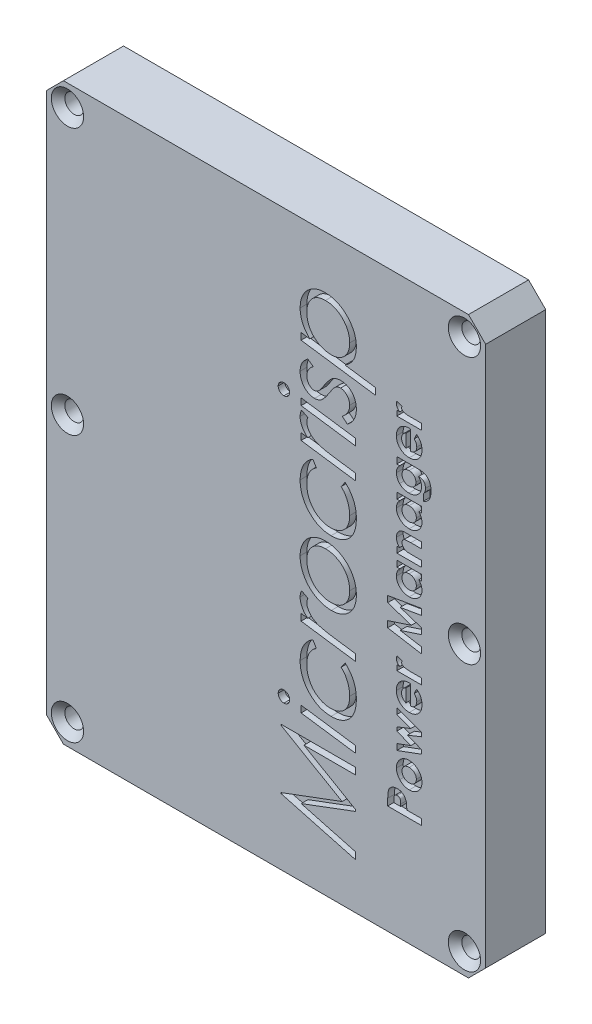
from build123d import *

# Parameters (mm, degrees)
SKETCH1_R           = 1.389
SKETCH1_W           = 55
SKETCH1_H           = 75
BOSS_EXTRUDE1_DEPTH = 8.89
SKETCH2_W           = 55
SKETCH2_H           = 75
BOSS_EXTRUDE2_DEPTH = 4
CHAMFER1_SIZE       = 1
CUT_EXTRUDE1_DEPTH  = 1


with BuildPart() as part:
    # Sketch1 → Boss-Extrude1 (new body)
    with BuildSketch(Plane.XY):
        Polygon((29.96, 42.5), (-29.96, 42.5), (-32.5, 39.96), (-32.5, -39.96), (-29.96, -42.5), (29.96, -42.5), (32.5, -39.96), (32.5, 39.96), align=None)
        with Locations(Location((29.365, 0, 0), (0, 0, 180))):
            Circle(SKETCH1_R, mode=Mode.SUBTRACT)
        with Locations(Location((29.365, -39.365, 0), (0, 0, 180))):
            Circle(SKETCH1_R, mode=Mode.SUBTRACT)
        with Locations(Location((29.365, 39.365, 0), (0, 0, 180))):
            Circle(SKETCH1_R, mode=Mode.SUBTRACT)
        with Locations(Location((-29.365, 39.365, 0), (0, 0, 180))):
            Circle(SKETCH1_R, mode=Mode.SUBTRACT)
        with Locations(Location((-29.365, -39.365, 0), (0, 0, 180))):
            Circle(SKETCH1_R, mode=Mode.SUBTRACT)
        with Locations(Location((-29.365, 0, 0), (0, 0, 180))):
            Circle(SKETCH1_R, mode=Mode.SUBTRACT)
        Rectangle(SKETCH1_W, SKETCH1_H, mode=Mode.SUBTRACT)
    extrude(amount=BOSS_EXTRUDE1_DEPTH)

    # Sketch2 → Boss-Extrude2 (add)
    with BuildSketch(Plane.XY.offset(8.89)):
        Rectangle(SKETCH2_W, SKETCH2_H)
    extrude(amount=-BOSS_EXTRUDE2_DEPTH)

    # Chamfer1
    chamfer1_edges = [part.edges().sort_by_distance(p)[0] for p in [
        (-27.976, 0, 8.89),
        (-27.976, -39.365, 8.89),
        (-27.976, 39.365, 8.89),
        (30.754, 39.365, 8.89),
        (30.754, -39.365, 8.89),
        (30.754, 0, 8.89),
    ]]
    chamfer(chamfer1_edges, length=CHAMFER1_SIZE)

    # Sketch3 → Cut-Extrude1 (cut)
    # profile 1 of 24: a face of its own
    with BuildSketch(Plane.XY.offset(8.89)):
        Polygon((2.234395684, -23.854487179), (13.234395684, -23.854487179), (13.234395684, -24.841666667), (5.62341812, -24.841666667), (13.234395684, -29.259735577), (13.234395684, -29.521955128), (5.213562351, -32.527564103), (13.234395684, -34.680408654), (13.234395684, -35.700641026), (2.234395684, -32.739102564), (2.234395684, -32.609094551), (11.268850812, -29.237700321), (2.234395684, -23.995512821), align=None)
    # profile 2 of 24: a face of its own
    with BuildSketch(Plane.XY.offset(8.89)):
        with BuildLine():
            add(Edge.make_bspline(
                [(1.811318761, -20.089102564), (1.8142201, -20.032976468), (1.819936061, -19.922401813), (1.867452123, -19.762464644), (1.949276221, -19.617684095), (2.056584977, -19.488214934), (2.186054138, -19.380906178), (2.330834687, -19.29908208), (2.490771856, -19.251566018), (2.601346511, -19.245850057), (2.657472607, -19.242948718)],
                knots=[0, 0, 0, 0, 1.013030613, 1.995783029, 2.982024995, 4, 5.017975005, 6.004216971, 6.986969387, 8, 8, 8, 8], degree=3))
            add(Edge.make_bspline(
                [(2.657472607, -19.242948718), (2.714298953, -19.245910085), (2.826248323, -19.251744055), (2.987521896, -19.298011783), (3.131447076, -19.381659589), (3.26043515, -19.488213632), (3.368295511, -19.617074177), (3.447005312, -19.763123986), (3.495161933, -19.922319318), (3.500776553, -20.032948693), (3.503626453, -20.089102564)],
                knots=[0, 0, 0, 0, 1.025223198, 2.019716202, 2.993394322, 4.010352233, 5.027310144, 6.006211027, 6.987981541, 8, 8, 8, 8], degree=3))
            add(Edge.make_bspline(
                [(3.503626453, -20.089102564), (3.500752038, -20.145977018), (3.495089365, -20.258021162), (3.447492181, -20.418885234), (3.368301657, -20.565619507), (3.260245689, -20.694034315), (3.132724756, -20.801839777), (2.986169631, -20.879174304), (2.82642349, -20.926780454), (2.714357931, -20.932402578), (2.657472607, -20.93525641)],
                knots=[0, 0, 0, 0, 1.023533904, 2.01638825, 2.993676166, 4.008958403, 5.024240639, 5.98361175, 6.976466096, 8, 8, 8, 8], degree=3))
            add(Edge.make_bspline(
                [(2.657472607, -20.93525641), (2.601289975, -20.93245986), (2.490603938, -20.926950346), (2.332155482, -20.87812654), (2.184795634, -20.802594418), (2.056770233, -20.694035502), (1.949269911, -20.565010149), (1.866955087, -20.419549677), (1.820011567, -20.257937044), (1.814245606, -20.145948696), (1.811318761, -20.089102564)],
                knots=[0, 0, 0, 0, 1.011340607, 1.992453529, 2.964486456, 3.980763207, 4.997039957, 5.981636608, 6.975463499, 8, 8, 8, 8], degree=3))
        make_face()
    # profile 3 of 24: a face of its own
    with BuildSketch(Plane.XY.offset(8.89)):
        Polygon((5.195934146, -20.922035256), (5.195934146, -19.928245192), (13.234395684, -21.069671474), (13.234395684, -22.063461538), align=None)
    # profile 4 of 24: a face of its own
    with BuildSketch(Plane.XY.offset(8.89)):
        with BuildLine():
            Line((6.954347607, -10.682692308), (7.452344402, -11.537660256))
            add(Edge.make_bspline(
                [(7.452344402, -11.537660256), (7.339886073, -11.6147922), (7.118884185, -11.766371059), (6.830510304, -12.041342174), (6.586798459, -12.344907267), (6.384790152, -12.677546487), (6.231020724, -13.041643383), (6.120941479, -13.435478486), (6.053858072, -13.858618147), (6.046082431, -14.150789519), (6.042087992, -14.30088141)],
                knots=[0, 0, 0, 0, 1.006368034, 1.977703555, 2.931287349, 3.876057278, 4.843853284, 5.842109818, 6.891466274, 8, 8, 8, 8], degree=3))
            add(Edge.make_bspline(
                [(6.042087992, -14.30088141), (6.047477837, -14.476768411), (6.058098637, -14.823357309), (6.145688545, -15.331458725), (6.292558235, -15.814648705), (6.459300722, -16.196986702), (6.620499874, -16.484401289), (6.753442363, -16.688002687), (6.896903992, -16.880148347), (7.050940153, -17.060975592), (7.216536668, -17.229885416), (7.39602853, -17.382877354), (7.583999458, -17.527929883), (7.848277733, -17.701673806), (8.195783398, -17.882789413), (8.631953514, -18.040820853), (9.082898963, -18.140116552), (9.389478428, -18.151388673), (9.543490235, -18.157051282)],
                knots=[0, 0, 0, 0, 1.454102064, 2.865337582, 4.249080667, 5.622785341, 6.305501153, 6.972770453, 7.632530544, 8.287518448, 8.936193138, 9.586572476, 10.23663963, 10.898828654, 12.200395727, 13.46683786, 14.727452674, 16, 16, 16, 16], degree=3))
            add(Edge.make_bspline(
                [(9.543490235, -18.157051282), (9.678264258, -18.153466554), (9.942415861, -18.146440634), (10.32696772, -18.071957943), (10.690880025, -17.959203562), (11.029308159, -17.796973442), (11.338531652, -17.59412128), (11.614099227, -17.353821628), (11.848684652, -17.072555179), (12.045020946, -16.756919734), (12.199432527, -16.40665258), (12.309386833, -16.025822529), (12.37662969, -15.615093901), (12.384292941, -15.330927188), (12.388241838, -15.184495192)],
                knots=[0, 0, 0, 0, 1.0459201, 2.049960865, 3.031812409, 3.99926177, 4.955298897, 5.89749, 6.829130969, 7.790366111, 8.776586463, 9.793327317, 10.862894671, 12, 12, 12, 12], degree=3))
            add(Edge.make_bspline(
                [(12.388241838, -15.184495192), (12.384040493, -15.03148487), (12.375699046, -14.727694621), (12.307563558, -14.277074458), (12.194777012, -13.838244695), (12.041044434, -13.41588011), (11.855878193, -13.021107709), (11.637838101, -12.667829344), (11.398098611, -12.356804002), (11.210421029, -12.185296841), (11.119011069, -12.101762821)],
                knots=[0, 0, 0, 0, 1.070010768, 2.124424235, 3.180001424, 4.234915574, 5.26459992, 6.22431616, 7.135138096, 8, 8, 8, 8], degree=3))
            Line((11.119011069, -12.101762821), (11.720573569, -11.246794872))
            add(Edge.make_bspline(
                [(11.720573569, -11.246794872), (11.856937022, -11.379395243), (12.123238994, -11.638348355), (12.469789085, -12.062139072), (12.755330105, -12.504795084), (12.986423997, -12.967018177), (13.161958226, -13.456872585), (13.286906396, -13.979841863), (13.363014263, -14.540292676), (13.371207939, -14.926435832), (13.375421325, -15.125)],
                knots=[0, 0, 0, 0, 1.047943377, 2.046511601, 3.010186843, 3.946393228, 4.889091914, 5.872171621, 6.90581909, 8, 8, 8, 8], degree=3))
            add(Edge.make_bspline(
                [(13.375421325, -15.125), (13.372874916, -15.278663319), (13.367914735, -15.577985885), (13.317367584, -16.014002488), (13.240642837, -16.424635657), (13.126603887, -16.808507599), (12.984711652, -17.167750155), (12.806251225, -17.499865707), (12.599996136, -17.808584693), (12.357927166, -18.085908715), (12.092004231, -18.334653446), (11.80365717, -18.552574663), (11.494196675, -18.73637502), (11.161730912, -18.88472677), (10.80885072, -19.001229766), (10.434089798, -19.085457444), (10.038326091, -19.133382695), (9.767642634, -19.140563928), (9.629427735, -19.144230769)],
                knots=[0, 0, 0, 0, 1.186108513, 2.310434577, 3.385001613, 4.408004163, 5.398069338, 6.362305923, 7.314066857, 8.259043224, 9.198094272, 10.12149539, 11.04463517, 11.971270749, 12.927281239, 13.909778843, 14.932702769, 16, 16, 16, 16], degree=3))
            add(Edge.make_bspline(
                [(9.629427735, -19.144230769), (9.474200518, -19.140175458), (9.168905653, -19.132199629), (8.719916055, -19.063684826), (8.287929049, -18.953489188), (7.872155234, -18.799504076), (7.475521048, -18.598110932), (7.093686778, -18.357705474), (6.731818207, -18.068680541), (6.390791795, -17.740010889), (6.078470068, -17.380884017), (5.804781019, -16.996283763), (5.573421619, -16.592474623), (5.381004625, -16.169021049), (5.237557054, -15.724019642), (5.129747604, -15.260757171), (5.068468269, -14.77701506), (5.059471518, -14.447947622), (5.054908505, -14.281049679)],
                knots=[0, 0, 0, 0, 1.002277488, 1.971240463, 2.926408626, 3.878259464, 4.828891444, 5.795073931, 6.788042611, 7.81489549, 8.85089398, 9.85806746, 10.85914251, 11.853029005, 12.856832748, 13.874314015, 14.921884765, 16, 16, 16, 16], degree=3))
            add(Edge.make_bspline(
                [(5.054908505, -14.281049679), (5.056972169, -14.180392734), (5.061044045, -13.981783651), (5.082208065, -13.688024537), (5.122483451, -13.40340528), (5.177339566, -13.127420736), (5.247615478, -12.860901469), (5.333807668, -12.602965568), (5.437680322, -12.355564699), (5.553859984, -12.116262427), (5.686503282, -11.890427619), (5.82966102, -11.67551553), (5.985679475, -11.474358048), (6.157302015, -11.28940844), (6.336818951, -11.114794222), (6.529485838, -10.955141489), (6.735907214, -10.811245091), (6.881048907, -10.725828798), (6.954347607, -10.682692308)],
                knots=[0, 0, 0, 0, 1.130526231, 2.230673465, 3.305038771, 4.35652049, 5.38890206, 6.398358211, 7.407848061, 8.400173956, 9.383407759, 10.346541702, 11.298591704, 12.238522806, 13.17772977, 14.109226261, 15.045131323, 16, 16, 16, 16], degree=3))
        make_face()
    # profile 5 of 24: a face of its own
    with BuildSketch(Plane.XY.offset(8.89)):
        with BuildLine():
            Line((5.195934146, -9.160496795), (5.195934146, -8.166706731))
            Line((5.195934146, -8.166706731), (6.180910107, -8.307732372))
            add(Edge.make_bspline(
                [(6.180910107, -8.307732372), (6.095419415, -8.237656028), (5.925839692, -8.098652276), (5.703922594, -7.857870267), (5.507206121, -7.599486638), (5.34657148, -7.320025539), (5.214394896, -7.030885345), (5.125988862, -6.732341359), (5.063826913, -6.43216535), (5.057872455, -6.229383988), (5.054908505, -6.128445513)],
                knots=[0, 0, 0, 0, 1.043977335, 2.070838174, 3.08750425, 4.108241552, 5.112306802, 6.085444777, 7.046991874, 8, 8, 8, 8], degree=3))
            add(Edge.make_bspline(
                [(5.054908505, -6.128445513), (5.057411246, -6.054792213), (5.062476977, -5.905712589), (5.106107426, -5.681067063), (5.167352372, -5.450865146), (5.231451455, -5.301442201), (5.26424344, -5.225)],
                knots=[0, 0, 0, 0, 0.945477896, 1.913715859, 2.932693025, 4, 4, 4, 4], degree=3))
            Line((5.26424344, -5.225), (6.198538312, -5.716386218))
            add(Edge.make_bspline(
                [(6.198538312, -5.716386218), (6.174655413, -5.776985794), (6.129445042, -5.891700901), (6.082440337, -6.059443772), (6.046844263, -6.210692741), (6.043613682, -6.307490785), (6.042087992, -6.353205128)],
                knots=[0, 0, 0, 0, 1.184196155, 2.241685462, 3.169609312, 4, 4, 4, 4], degree=3))
            add(Edge.make_bspline(
                [(6.042087992, -6.353205128), (6.046224721, -6.442513317), (6.054584277, -6.622988483), (6.127657081, -6.891538159), (6.244029598, -7.157048115), (6.402508913, -7.419066291), (6.605080075, -7.668092224), (6.851944161, -7.893829241), (7.141304859, -8.092931669), (7.412985575, -8.240216538), (7.662438586, -8.34355205), (7.881692024, -8.420548556), (8.131140006, -8.49476908), (8.410296659, -8.567366975), (8.720017035, -8.63494335), (9.058814567, -8.700433156), (9.427367157, -8.765233397), (9.683667915, -8.80204366), (9.816727415, -8.821153846)],
                knots=[0, 0, 0, 0, 0.867875276, 1.753813803, 2.688665428, 3.682875619, 4.724472146, 5.802042884, 6.926395328, 8.135278834, 8.80170755, 9.55229766, 10.39581001, 11.333771904, 12.358753246, 13.480261787, 14.691868459, 16, 16, 16, 16], degree=3))
            Line((9.816727415, -8.821153846), (13.234395684, -9.308133013))
            Line((13.234395684, -9.308133013), (13.234395684, -10.301923077))
            Line((13.234395684, -10.301923077), (5.195934146, -9.160496795))
        make_face()
    # profile 6 of 24: a face of its own
    with BuildSketch(Plane.XY.offset(8.89)):
        with BuildLine():
            add(Edge.make_bspline(
                [(5.054908505, -0.855849359), (5.055749631, -0.769841385), (5.057421005, -0.598937712), (5.083981217, -0.345304294), (5.120108666, -0.096361786), (5.173028041, 0.146669601), (5.242602156, 0.383035658), (5.322931883, 0.615936489), (5.42328307, 0.841614579), (5.534506875, 1.062773692), (5.662724534, 1.2731515), (5.801683491, 1.474083037), (5.951081918, 1.664581982), (6.11463106, 1.840697582), (6.289700891, 2.004213492), (6.475453657, 2.157193005), (6.673422924, 2.2980096), (6.882954905, 2.425318915), (7.10101222, 2.540544644), (7.328040538, 2.639505054), (7.562561961, 2.722667118), (7.802503467, 2.794501051), (8.050989989, 2.847059785), (8.306518335, 2.8832695), (8.568983796, 2.909711723), (8.74648066, 2.911351176), (8.836158505, 2.912179487)],
                knots=[0, 0, 0, 0, 1.036231266, 2.05906177, 3.070795999, 4.067621699, 5.053932983, 6.039608245, 7.03478116, 8.028653529, 9.021697392, 10.001629878, 10.972319408, 11.937176971, 12.895553847, 13.858011718, 14.835781968, 15.821258389, 16.81133764, 17.806510555, 18.80349352, 19.809283062, 20.823416328, 21.861423808, 22.919513846, 24, 24, 24, 24], degree=3))
            add(Edge.make_bspline(
                [(8.836158505, 2.912179487), (8.939082459, 2.910933531), (9.14320808, 2.908462468), (9.446216477, 2.874975993), (9.744512361, 2.827584086), (10.036956327, 2.759490083), (10.323261858, 2.670661852), (10.602981544, 2.561575429), (10.879813926, 2.437401764), (11.146697329, 2.2883281), (11.405662205, 2.127920492), (11.648967532, 1.949718983), (11.878638521, 1.760777382), (12.092819291, 1.557478547), (12.291723178, 1.341113567), (12.475415005, 1.11039971), (12.64466645, 0.867149945), (12.796686907, 0.61030198), (12.933210071, 0.344102096), (13.053524455, 0.06795233), (13.151272252, -0.218543796), (13.233597259, -0.512710998), (13.29717397, -0.815276079), (13.344080786, -1.127119738), (13.370254452, -1.448141239), (13.373689112, -1.665232969), (13.375421325, -1.774719551)],
                knots=[0, 0, 0, 0, 1.017096086, 2.017172488, 3.010476167, 4.002212387, 4.983013789, 5.971554287, 6.969228465, 7.980005103, 8.991485852, 9.979225805, 10.959247246, 11.930104733, 12.896361296, 13.862645148, 14.843688482, 15.823844443, 16.811183879, 17.800017749, 18.79903894, 19.801564416, 20.818504939, 21.853742402, 22.917570888, 24, 24, 24, 24], degree=3))
            add(Edge.make_bspline(
                [(13.375421325, -1.774719551), (13.373013677, -1.909316979), (13.368298564, -2.172911161), (13.314974776, -2.558410608), (13.234043834, -2.925704496), (13.122220801, -3.276528558), (12.973960362, -3.608099138), (12.791493906, -3.920216004), (12.579057652, -4.215403156), (12.335448672, -4.488540402), (12.067919611, -4.737915836), (11.778210592, -4.953690477), (11.471931546, -5.139133912), (11.146453454, -5.288960344), (10.803062385, -5.4060719), (10.442241228, -5.490191479), (10.063364695, -5.538501901), (9.805111155, -5.545693794), (9.673498248, -5.549358974)],
                knots=[0, 0, 0, 0, 1.089674992, 2.134008013, 3.145972071, 4.133859371, 5.111370702, 6.081903096, 7.057892049, 8.052583146, 9.042046082, 10.015492447, 10.973689396, 11.937412751, 12.912113077, 13.907995838, 14.933858765, 16, 16, 16, 16], degree=3))
            add(Edge.make_bspline(
                [(9.673498248, -5.549358974), (9.569106085, -5.548115792), (9.362050947, -5.545650021), (9.054649144, -5.51211669), (8.752635477, -5.465022041), (8.45659059, -5.396492487), (8.167794898, -5.307479794), (7.88348784, -5.202246004), (7.606973979, -5.073353608), (7.336195677, -4.928963669), (7.076762161, -4.766569982), (6.832004751, -4.586941105), (6.599429683, -4.395018161), (6.380912205, -4.187937682), (6.17825902, -3.965016505), (5.990794053, -3.728028998), (5.815574492, -3.478821311), (5.657608189, -3.215002356), (5.517809055, -2.940467567), (5.393774953, -2.659627396), (5.287045735, -2.374006594), (5.203977153, -2.08103764), (5.137592791, -1.783073548), (5.089079988, -1.479256952), (5.05939815, -1.169347639), (5.056413658, -0.96094967), (5.054908505, -0.855849359)],
                knots=[0, 0, 0, 0, 1.024581915, 2.032192303, 3.032964681, 4.024965971, 5.012868499, 5.998847164, 6.999281616, 8.006065627, 9.010651276, 10.001734447, 10.985230267, 11.969862633, 12.955234372, 13.940843648, 14.935280393, 15.944618814, 16.957481499, 17.958565709, 18.958063765, 19.94877945, 20.946219556, 21.954113854, 22.96820842, 24, 24, 24, 24], degree=3))
        make_face()
        with BuildLine():
            add(Edge.make_bspline(
                [(6.042087992, -0.884495192), (6.047276863, -1.047969603), (6.057568483, -1.372205108), (6.149860078, -1.849562179), (6.296052013, -2.312066493), (6.465248893, -2.681874179), (6.63041873, -2.96190469), (6.760707233, -3.16392443), (6.908171533, -3.349293004), (7.064824488, -3.523012694), (7.229039752, -3.687299446), (7.407625873, -3.83568411), (7.596302246, -3.971610227), (7.860597616, -4.136114486), (8.21054784, -4.307074469), (8.65474573, -4.455734783), (9.121111132, -4.546735542), (9.439517074, -4.556987248), (9.600781902, -4.562179487)],
                knots=[0, 0, 0, 0, 1.372607469, 2.72243265, 4.069361738, 5.441969207, 6.127960618, 6.800745981, 7.460118614, 8.115724862, 8.766050818, 9.410137079, 10.064521862, 10.718790197, 12.024485085, 13.326381282, 14.64587746, 16, 16, 16, 16], degree=3))
            add(Edge.make_bspline(
                [(9.600781902, -4.562179487), (9.701518609, -4.559520391), (9.899294872, -4.55429979), (10.188762288, -4.516836511), (10.463237136, -4.45279929), (10.722952206, -4.363943545), (10.96912461, -4.252045739), (11.199940318, -4.111438789), (11.416316426, -3.945862983), (11.615880931, -3.755733745), (11.799178303, -3.548740805), (11.954805051, -3.321426138), (12.092517929, -3.082886491), (12.198068793, -2.825462363), (12.286188531, -2.55645457), (12.343780948, -2.270946224), (12.383460463, -1.971956845), (12.386629016, -1.76677774), (12.388241838, -1.662339744)],
                knots=[0, 0, 0, 0, 1.06976001, 2.10025861, 3.093683297, 4.058265469, 5.011200315, 5.95975059, 6.922438203, 7.899183141, 8.883283448, 9.852774146, 10.820379896, 11.80271622, 12.801882589, 13.822382016, 14.891573005, 16, 16, 16, 16], degree=3))
            add(Edge.make_bspline(
                [(12.388241838, -1.662339744), (12.382767646, -1.498914945), (12.372015842, -1.17793403), (12.286271832, -0.708869607), (12.14456405, -0.263479657), (11.945615659, 0.1545526), (11.697356042, 0.542898295), (11.393292992, 0.889748194), (11.040598434, 1.196607869), (10.640433784, 1.453268073), (10.210545631, 1.661824218), (9.760696878, 1.816692803), (9.292903101, 1.906321247), (8.97608568, 1.91873847), (8.816326774, 1.925)],
                knots=[0, 0, 0, 0, 1.041123595, 2.044859823, 3.027977637, 4.012254106, 4.987514999, 5.956439961, 6.94210724, 7.957599344, 8.977323917, 9.981114737, 10.981953385, 12, 12, 12, 12], degree=3))
            add(Edge.make_bspline(
                [(8.816326774, 1.925), (8.683786507, 1.921227579), (8.424924223, 1.913859725), (8.048844627, 1.842724568), (7.695756329, 1.731054376), (7.367937186, 1.573752334), (7.069122298, 1.3755249), (6.805206997, 1.136461049), (6.572022141, 0.863679981), (6.383553024, 0.552440606), (6.23063999, 0.218344664), (6.123010371, -0.135950127), (6.05429598, -0.50503097), (6.046185821, -0.757121259), (6.042087992, -0.884495192)],
                knots=[0, 0, 0, 0, 1.077071248, 2.103610688, 3.101229692, 4.081942498, 5.051306621, 6.007415918, 6.969758249, 7.959618594, 8.956933422, 9.950967982, 10.964683377, 12, 12, 12, 12], degree=3))
        make_face(mode=Mode.SUBTRACT)
    # profile 7 of 24: a face of its own
    with BuildSketch(Plane.XY.offset(8.89)):
        with BuildLine():
            Line((6.954347607, 12.459615385), (7.452344402, 11.604647436))
            add(Edge.make_bspline(
                [(7.452344402, 11.604647436), (7.339886073, 11.527515492), (7.118884185, 11.375936633), (6.830510304, 11.100965518), (6.586798459, 10.797400426), (6.384790152, 10.464761206), (6.231020724, 10.100664309), (6.120941479, 9.706829206), (6.053858072, 9.283689545), (6.046082431, 8.991518174), (6.042087992, 8.841426282)],
                knots=[0, 0, 0, 0, 1.006368034, 1.977703555, 2.931287349, 3.876057278, 4.843853284, 5.842109818, 6.891466274, 8, 8, 8, 8], degree=3))
            add(Edge.make_bspline(
                [(6.042087992, 8.841426282), (6.047477837, 8.665539282), (6.058098637, 8.318950383), (6.145688545, 7.810848968), (6.292558235, 7.327658988), (6.459300722, 6.94532099), (6.620499874, 6.657906403), (6.753442363, 6.454305005), (6.896903992, 6.262159345), (7.050940153, 6.0813321), (7.216536668, 5.912422276), (7.39602853, 5.759430339), (7.583999458, 5.614377809), (7.848277733, 5.440633886), (8.195783398, 5.25951828), (8.631953514, 5.101486839), (9.082898963, 5.002191141), (9.389478428, 4.99091902), (9.543490235, 4.98525641)],
                knots=[0, 0, 0, 0, 1.454102064, 2.865337582, 4.249080667, 5.622785341, 6.305501153, 6.972770453, 7.632530544, 8.287518448, 8.936193138, 9.586572476, 10.23663963, 10.898828654, 12.200395727, 13.46683786, 14.727452674, 16, 16, 16, 16], degree=3))
            add(Edge.make_bspline(
                [(9.543490235, 4.98525641), (9.678264258, 4.988841138), (9.942415861, 4.995867058), (10.32696772, 5.070349749), (10.690880025, 5.183104131), (11.029308159, 5.34533425), (11.338531652, 5.548186412), (11.614099227, 5.788486064), (11.848684652, 6.069752513), (12.045020946, 6.385387958), (12.199432527, 6.735655112), (12.309386833, 7.116485163), (12.37662969, 7.527213792), (12.384292941, 7.811380505), (12.388241838, 7.9578125)],
                knots=[0, 0, 0, 0, 1.0459201, 2.049960865, 3.031812409, 3.99926177, 4.955298897, 5.89749, 6.829130969, 7.790366111, 8.776586463, 9.793327317, 10.862894671, 12, 12, 12, 12], degree=3))
            add(Edge.make_bspline(
                [(12.388241838, 7.9578125), (12.384040493, 8.110822822), (12.375699046, 8.414613071), (12.307563558, 8.865233234), (12.194777012, 9.304062997), (12.041044434, 9.726427582), (11.855878193, 10.121199984), (11.637838101, 10.474478348), (11.398098611, 10.78550369), (11.210421029, 10.957010852), (11.119011069, 11.040544872)],
                knots=[0, 0, 0, 0, 1.070010768, 2.124424235, 3.180001424, 4.234915574, 5.26459992, 6.22431616, 7.135138096, 8, 8, 8, 8], degree=3))
            Line((11.119011069, 11.040544872), (11.720573569, 11.895512821))
            add(Edge.make_bspline(
                [(11.720573569, 11.895512821), (11.856937022, 11.762912449), (12.123238994, 11.503959337), (12.469789085, 11.08016862), (12.755330105, 10.637512609), (12.986423997, 10.175289515), (13.161958226, 9.685435107), (13.286906396, 9.16246583), (13.363014263, 8.602015017), (13.371207939, 8.21587186), (13.375421325, 8.017307692)],
                knots=[0, 0, 0, 0, 1.047943377, 2.046511601, 3.010186843, 3.946393228, 4.889091914, 5.872171621, 6.90581909, 8, 8, 8, 8], degree=3))
            add(Edge.make_bspline(
                [(13.375421325, 8.017307692), (13.372874916, 7.863644374), (13.367914735, 7.564321807), (13.317367584, 7.128305204), (13.240642837, 6.717672035), (13.126603887, 6.333800093), (12.984711652, 5.974557537), (12.806251225, 5.642441986), (12.599996136, 5.333722999), (12.357927166, 5.056398978), (12.092004231, 4.807654246), (11.80365717, 4.589733029), (11.494196675, 4.405932673), (11.161730912, 4.257580923), (10.80885072, 4.141077927), (10.434089798, 4.056850249), (10.038326091, 4.008924997), (9.767642634, 4.001743764), (9.629427735, 3.998076923)],
                knots=[0, 0, 0, 0, 1.186108513, 2.310434577, 3.385001613, 4.408004163, 5.398069338, 6.362305923, 7.314066857, 8.259043224, 9.198094272, 10.12149539, 11.04463517, 11.971270749, 12.927281239, 13.909778843, 14.932702769, 16, 16, 16, 16], degree=3))
            add(Edge.make_bspline(
                [(9.629427735, 3.998076923), (9.474200518, 4.002132235), (9.168905653, 4.010108064), (8.719916055, 4.078622867), (8.287929049, 4.188818504), (7.872155234, 4.342803616), (7.475521048, 4.544196761), (7.093686778, 4.784602218), (6.731818207, 5.073627151), (6.390791795, 5.402296803), (6.078470068, 5.761423675), (5.804781019, 6.146023929), (5.573421619, 6.549833069), (5.381004625, 6.973286644), (5.237557054, 7.418288051), (5.129747604, 7.881550521), (5.068468269, 8.365292632), (5.059471518, 8.69436007), (5.054908505, 8.861258013)],
                knots=[0, 0, 0, 0, 1.002277488, 1.971240463, 2.926408626, 3.878259464, 4.828891444, 5.795073931, 6.788042611, 7.81489549, 8.85089398, 9.85806746, 10.85914251, 11.853029005, 12.856832748, 13.874314015, 14.921884765, 16, 16, 16, 16], degree=3))
            add(Edge.make_bspline(
                [(5.054908505, 8.861258013), (5.056972169, 8.961914958), (5.061044045, 9.160524041), (5.082208065, 9.454283155), (5.122483451, 9.738902412), (5.177339566, 10.014886956), (5.247615478, 10.281406223), (5.333807668, 10.539342124), (5.437680322, 10.786742993), (5.553859984, 11.026045266), (5.686503282, 11.251880074), (5.82966102, 11.466792162), (5.985679475, 11.667949644), (6.157302015, 11.852899252), (6.336818951, 12.027513471), (6.529485838, 12.187166203), (6.735907214, 12.331062602), (6.881048907, 12.416478895), (6.954347607, 12.459615385)],
                knots=[0, 0, 0, 0, 1.130526231, 2.230673465, 3.305038771, 4.35652049, 5.38890206, 6.398358211, 7.407848061, 8.400173956, 9.383407759, 10.346541702, 11.298591704, 12.238522806, 13.17772977, 14.109226261, 15.045131323, 16, 16, 16, 16], degree=3))
        make_face()
    # profile 8 of 24: a face of its own
    with BuildSketch(Plane.XY.offset(8.89)):
        with BuildLine():
            Line((5.195934146, 13.981810897), (5.195934146, 14.975600962))
            Line((5.195934146, 14.975600962), (6.180910107, 14.834575321))
            add(Edge.make_bspline(
                [(6.180910107, 14.834575321), (6.095419415, 14.904651664), (5.925839692, 15.043655417), (5.703922594, 15.284437426), (5.507206121, 15.542821054), (5.34657148, 15.822282153), (5.214394896, 16.111422348), (5.125988862, 16.409966334), (5.063826913, 16.710142343), (5.057872455, 16.912923704), (5.054908505, 17.013862179)],
                knots=[0, 0, 0, 0, 1.043977335, 2.070838174, 3.08750425, 4.108241552, 5.112306802, 6.085444777, 7.046991874, 8, 8, 8, 8], degree=3))
            add(Edge.make_bspline(
                [(5.054908505, 17.013862179), (5.057411246, 17.08751548), (5.062476977, 17.236595103), (5.106107426, 17.461240629), (5.167352372, 17.691442546), (5.231451455, 17.840865491), (5.26424344, 17.917307692)],
                knots=[0, 0, 0, 0, 0.945477896, 1.913715859, 2.932693025, 4, 4, 4, 4], degree=3))
            Line((5.26424344, 17.917307692), (6.198538312, 17.425921474))
            add(Edge.make_bspline(
                [(6.198538312, 17.425921474), (6.174655413, 17.365321898), (6.129445042, 17.250606791), (6.082440337, 17.08286392), (6.046844263, 16.931614951), (6.043613682, 16.834816907), (6.042087992, 16.789102564)],
                knots=[0, 0, 0, 0, 1.184196155, 2.241685462, 3.169609312, 4, 4, 4, 4], degree=3))
            add(Edge.make_bspline(
                [(6.042087992, 16.789102564), (6.046224721, 16.699794375), (6.054584277, 16.51931921), (6.127657081, 16.250769533), (6.244029598, 15.985259577), (6.402508913, 15.723241402), (6.605080075, 15.474215468), (6.851944161, 15.248478452), (7.141304859, 15.049376023), (7.412985575, 14.902091155), (7.662438586, 14.798755643), (7.881692024, 14.721759136), (8.131140006, 14.647538613), (8.410296659, 14.574940718), (8.720017035, 14.507364342), (9.058814567, 14.441874537), (9.427367157, 14.377074295), (9.683667915, 14.340264032), (9.816727415, 14.321153846)],
                knots=[0, 0, 0, 0, 0.867875276, 1.753813803, 2.688665428, 3.682875619, 4.724472146, 5.802042884, 6.926395328, 8.135278834, 8.80170755, 9.55229766, 10.39581001, 11.333771904, 12.358753246, 13.480261787, 14.691868459, 16, 16, 16, 16], degree=3))
            Line((9.816727415, 14.321153846), (13.234395684, 13.834174679))
            Line((13.234395684, 13.834174679), (13.234395684, 12.840384615))
            Line((13.234395684, 12.840384615), (5.195934146, 13.981810897))
        make_face()
    # profile 9 of 24: a face of its own
    with BuildSketch(Plane.XY.offset(8.89)):
        with BuildLine():
            add(Edge.make_bspline(
                [(1.811318761, 19.28525641), (1.8142201, 19.341382506), (1.819936061, 19.451957161), (1.867452123, 19.61189433), (1.949276221, 19.756674879), (2.056584977, 19.886144041), (2.186054138, 19.993452796), (2.330834687, 20.075276894), (2.490771856, 20.122792957), (2.601346511, 20.128508917), (2.657472607, 20.131410256)],
                knots=[0, 0, 0, 0, 1.013030613, 1.995783029, 2.982024995, 4, 5.017975005, 6.004216971, 6.986969387, 8, 8, 8, 8], degree=3))
            add(Edge.make_bspline(
                [(2.657472607, 20.131410256), (2.714298953, 20.128448889), (2.826248323, 20.122614919), (2.987521896, 20.076347192), (3.131447076, 19.992699386), (3.26043515, 19.886145342), (3.368295511, 19.757284797), (3.447005312, 19.611234989), (3.495161933, 19.452039656), (3.500776553, 19.341410281), (3.503626453, 19.28525641)],
                knots=[0, 0, 0, 0, 1.025223198, 2.019716202, 2.993394322, 4.010352233, 5.027310144, 6.006211027, 6.987981541, 8, 8, 8, 8], degree=3))
            add(Edge.make_bspline(
                [(3.503626453, 19.28525641), (3.500752038, 19.228381957), (3.495089365, 19.116337813), (3.447492181, 18.955473741), (3.368301657, 18.808739467), (3.260245689, 18.680324659), (3.132724756, 18.572519198), (2.986169631, 18.495184671), (2.82642349, 18.44757852), (2.714357931, 18.441956396), (2.657472607, 18.439102564)],
                knots=[0, 0, 0, 0, 1.023533904, 2.01638825, 2.993676166, 4.008958403, 5.024240639, 5.98361175, 6.976466096, 8, 8, 8, 8], degree=3))
            add(Edge.make_bspline(
                [(2.657472607, 18.439102564), (2.601289975, 18.441899114), (2.490603938, 18.447408629), (2.332155482, 18.496232435), (2.184795634, 18.571764556), (2.056770233, 18.680323472), (1.949269911, 18.809348825), (1.866955087, 18.954809297), (1.820011567, 19.11642193), (1.814245606, 19.228410279), (1.811318761, 19.28525641)],
                knots=[0, 0, 0, 0, 1.011340607, 1.992453529, 2.964486456, 3.980763207, 4.997039957, 5.981636608, 6.975463499, 8, 8, 8, 8], degree=3))
        make_face()
    # profile 10 of 24: a face of its own
    with BuildSketch(Plane.XY.offset(8.89)):
        Polygon((5.195934146, 18.452323718), (5.195934146, 19.446113782), (13.234395684, 18.3046875), (13.234395684, 17.310897436), align=None)
    # profile 11 of 24: a face of its own
    with BuildSketch(Plane.XY.offset(8.89)):
        with BuildLine():
            Line((6.172096005, 24.919230769), (7.016046325, 24.355128205))
            add(Edge.make_bspline(
                [(7.016046325, 24.355128205), (6.938387557, 24.296423861), (6.788564112, 24.183168302), (6.590789122, 23.993202794), (6.422126308, 23.797581714), (6.283347286, 23.592271333), (6.174034549, 23.378907), (6.099474197, 23.155082884), (6.050682212, 22.924947621), (6.044962828, 22.76810129), (6.042087992, 22.689262821)],
                knots=[0, 0, 0, 0, 1.162881472, 2.24349309, 3.271115068, 4.24523942, 5.199453026, 6.12686972, 7.058475103, 8, 8, 8, 8], degree=3))
            add(Edge.make_bspline(
                [(6.042087992, 22.689262821), (6.046551331, 22.600789798), (6.055293829, 22.427494611), (6.1172363, 22.177021267), (6.225702484, 21.948176911), (6.371734773, 21.745988793), (6.543220545, 21.579296847), (6.725488218, 21.4500455), (6.922112457, 21.372864793), (7.05730031, 21.363135163), (7.124019081, 21.358333333)],
                knots=[0, 0, 0, 0, 1.1246638, 2.202918122, 3.255794346, 4.326335444, 5.356683615, 6.284105144, 7.153160631, 8, 8, 8, 8], degree=3))
            add(Edge.make_bspline(
                [(7.124019081, 21.358333333), (7.176450149, 21.361557766), (7.282382936, 21.368072473), (7.438297178, 21.413697906), (7.588806627, 21.490836321), (7.680308233, 21.560281507), (7.727785107, 21.596314103)],
                knots=[0, 0, 0, 0, 0.950295928, 1.919997081, 2.920761717, 4, 4, 4, 4], degree=3))
            add(Edge.make_bspline(
                [(7.727785107, 21.596314103), (7.753119963, 21.617961917), (7.808088919, 21.664931112), (7.889562681, 21.750617687), (7.979198536, 21.853571665), (8.075903354, 21.975129308), (8.179316999, 22.11415467), (8.289343173, 22.270784803), (8.406545004, 22.445862349), (8.486004755, 22.569403151), (8.527664915, 22.634174679)],
                knots=[0, 0, 0, 0, 0.608017265, 1.319213129, 2.155545981, 3.100017726, 4.153987869, 5.318432456, 6.594073975, 8, 8, 8, 8], degree=3))
            add(Edge.make_bspline(
                [(8.527664915, 22.634174679), (8.588892657, 22.728502791), (8.707029531, 22.910505717), (8.88540115, 23.168571712), (9.058078719, 23.402392389), (9.220725374, 23.614078129), (9.381415219, 23.797818365), (9.532551401, 23.959068003), (9.677250915, 24.097298557), (9.776472894, 24.175134919), (9.823337992, 24.211899038)],
                knots=[0, 0, 0, 0, 1.315912854, 2.539009681, 3.670165071, 4.717245177, 5.661645062, 6.525009009, 7.303323742, 8, 8, 8, 8], degree=3))
            add(Edge.make_bspline(
                [(9.823337992, 24.211899038), (9.916390468, 24.271624278), (10.102262188, 24.390925059), (10.41266971, 24.51342466), (10.742991343, 24.588735969), (10.970226387, 24.597473178), (11.085958184, 24.601923077)],
                knots=[0, 0, 0, 0, 0.986576379, 1.97067994, 2.966458459, 4, 4, 4, 4], degree=3))
            add(Edge.make_bspline(
                [(11.085958184, 24.601923077), (11.166848965, 24.599814503), (11.325657138, 24.595674864), (11.558748141, 24.5628291), (11.780068501, 24.503573449), (11.993050906, 24.428772118), (12.192018454, 24.324169892), (12.383699294, 24.203849548), (12.562093688, 24.056700671), (12.728817808, 23.889914253), (12.880465022, 23.705606501), (13.01301063, 23.506170099), (13.127267371, 23.293669744), (13.21538087, 23.065492504), (13.290412427, 22.826175238), (13.339870659, 22.572722478), (13.368395301, 22.305772769), (13.373039359, 22.123762718), (13.375421325, 22.030408654)],
                knots=[0, 0, 0, 0, 1.006031968, 1.97508416, 2.919091107, 3.852650505, 4.776096175, 5.708761016, 6.663363506, 7.645336394, 8.638508527, 9.626751735, 10.619923868, 11.632777871, 12.66453407, 13.736017397, 14.83878952, 16, 16, 16, 16], degree=3))
            add(Edge.make_bspline(
                [(13.375421325, 22.030408654), (13.372146876, 21.906703188), (13.365688478, 21.662711305), (13.298269604, 21.305668194), (13.194926456, 20.962841532), (13.048923288, 20.63525097), (12.858814752, 20.323790013), (12.627102545, 20.028591572), (12.358726379, 19.742757503), (12.150971379, 19.575478293), (12.044491838, 19.48974359)],
                knots=[0, 0, 0, 0, 0.996214386, 1.964894786, 2.918306781, 3.877858947, 4.847678854, 5.852077816, 6.899137121, 8, 8, 8, 8], degree=3))
            Line((12.044491838, 19.48974359), (11.29529312, 20.122155449))
            add(Edge.make_bspline(
                [(11.29529312, 20.122155449), (11.381850879, 20.197090516), (11.550157588, 20.34279755), (11.77288209, 20.57900289), (11.961653453, 20.820303039), (12.117871048, 21.065219982), (12.23827094, 21.316885703), (12.325064904, 21.573366104), (12.377522677, 21.835843469), (12.384668331, 22.012550936), (12.388241838, 22.100921474)],
                knots=[0, 0, 0, 0, 1.175260825, 2.28522875, 3.327945536, 4.317889614, 5.262654492, 6.185850448, 7.092752699, 8, 8, 8, 8], degree=3))
            add(Edge.make_bspline(
                [(12.388241838, 22.100921474), (12.382956585, 22.199790516), (12.372582296, 22.393858025), (12.296205342, 22.675888818), (12.162340843, 22.934368893), (11.985458277, 23.166622985), (11.778353388, 23.364778565), (11.545213957, 23.509296968), (11.29415493, 23.598198368), (11.120441584, 23.609206913), (11.033073569, 23.61474359)],
                knots=[0, 0, 0, 0, 1.057088376, 2.07493169, 3.097495111, 4.151952092, 5.185893189, 6.145382094, 7.067231792, 8, 8, 8, 8], degree=3))
            add(Edge.make_bspline(
                [(11.033073569, 23.61474359), (10.960645979, 23.610214864), (10.813781096, 23.60103175), (10.597393827, 23.533798443), (10.386809186, 23.423791766), (10.259572606, 23.323203866), (10.193530299, 23.27099359)],
                knots=[0, 0, 0, 0, 0.937825516, 1.901673589, 2.910861039, 4, 4, 4, 4], degree=3))
            add(Edge.make_bspline(
                [(10.193530299, 23.27099359), (10.169717933, 23.24852844), (10.116388566, 23.198216253), (10.035075104, 23.106545682), (9.943480734, 22.991808982), (9.839432767, 22.854723244), (9.72510563, 22.693589423), (9.599977634, 22.507645635), (9.461198298, 22.299954072), (9.367601485, 22.151824104), (9.31873062, 22.074479167)],
                knots=[0, 0, 0, 0, 0.528735733, 1.184138583, 1.977397547, 2.900699476, 3.964345913, 5.169055605, 6.521843901, 8, 8, 8, 8], degree=3))
            add(Edge.make_bspline(
                [(9.31873062, 22.074479167), (9.263993499, 21.990513446), (9.159075574, 21.829571308), (9.001790197, 21.600572165), (8.85075662, 21.395113606), (8.707423705, 21.210205242), (8.569538679, 21.050140441), (8.438049302, 20.912585394), (8.316921916, 20.794063177), (8.232278565, 20.729599688), (8.192729017, 20.699479167)],
                knots=[0, 0, 0, 0, 1.34719553, 2.582250547, 3.733450284, 4.774243204, 5.726214611, 6.57116838, 7.332379392, 8, 8, 8, 8], degree=3))
            add(Edge.make_bspline(
                [(8.192729017, 20.699479167), (8.117813748, 20.649104294), (7.969266783, 20.549217656), (7.720588347, 20.446041265), (7.457128942, 20.381422469), (7.275711597, 20.374613966), (7.183514274, 20.371153846)],
                knots=[0, 0, 0, 0, 1.00160212, 1.986043105, 2.97649569, 4, 4, 4, 4], degree=3))
            add(Edge.make_bspline(
                [(7.183514274, 20.371153846), (7.110696333, 20.37339063), (6.968064478, 20.377771921), (6.7571423, 20.408944438), (6.555610524, 20.464076696), (6.362012761, 20.540582207), (6.175092451, 20.633690163), (6.001093727, 20.756763906), (5.830137979, 20.893593112), (5.673737922, 21.055317723), (5.52736252, 21.22965036), (5.403396159, 21.420490391), (5.292333138, 21.619120045), (5.208231433, 21.832606104), (5.138533258, 22.055474926), (5.091644157, 22.290406139), (5.05845417, 22.53553914), (5.056104786, 22.703100804), (5.054908505, 22.788421474)],
                knots=[0, 0, 0, 0, 0.973122574, 1.906099992, 2.842016741, 3.75900101, 4.685395854, 5.624807143, 6.601488487, 7.60805505, 8.626188168, 9.639054185, 10.645046115, 11.662279591, 12.699450141, 13.762229163, 14.860550179, 16, 16, 16, 16], degree=3))
            add(Edge.make_bspline(
                [(5.054908505, 22.788421474), (5.05767596, 22.889249674), (5.063100046, 23.086868289), (5.111444345, 23.374876141), (5.185471812, 23.64919051), (5.295303259, 23.912180147), (5.447255557, 24.167944636), (5.643229479, 24.422251589), (5.887954371, 24.675938841), (6.074435398, 24.835610369), (6.172096005, 24.919230769)],
                knots=[0, 0, 0, 0, 0.967344967, 1.895951455, 2.79583959, 3.690323775, 4.622777875, 5.64391368, 6.766111372, 8, 8, 8, 8], degree=3))
        make_face()
    # profile 12 of 24: a face of its own
    with BuildSketch(Plane.XY.offset(8.89)):
        with BuildLine():
            Line((5.195934146, 26.829246795), (5.195934146, 27.823036859))
            Line((5.195934146, 27.823036859), (6.48279312, 27.640144231))
            add(Edge.make_bspline(
                [(6.48279312, 27.640144231), (6.368704933, 27.758464565), (6.145114668, 27.990349), (5.856633418, 28.369001236), (5.607655507, 28.756085376), (5.405423955, 29.158607499), (5.247705363, 29.573444022), (5.139027952, 30.001707678), (5.066311039, 30.44128778), (5.058739411, 30.739475078), (5.054908505, 30.890344551)],
                knots=[0, 0, 0, 0, 1.080607595, 2.117776994, 3.125932338, 4.104965205, 5.076130282, 6.039617854, 7.008134075, 8, 8, 8, 8], degree=3))
            add(Edge.make_bspline(
                [(5.054908505, 30.890344551), (5.057261017, 31.027162236), (5.06188197, 31.295908091), (5.116227364, 31.688272369), (5.192171706, 32.063507163), (5.309546684, 32.417434639), (5.453284141, 32.755146149), (5.636514458, 33.069850786), (5.846542297, 33.369141943), (6.090568532, 33.643676677), (6.357929339, 33.895341762), (6.648068623, 34.11378156), (6.955621504, 34.30147896), (7.284438521, 34.450150788), (7.629004849, 34.570864023), (7.993293106, 34.654313127), (8.376511842, 34.702714113), (8.638435863, 34.709827312), (8.772256261, 34.713461538)],
                knots=[0, 0, 0, 0, 1.096574693, 2.153960612, 3.171944772, 4.163100383, 5.139366468, 6.110517399, 7.07823125, 8.067511612, 9.051215349, 10.018588408, 10.97540927, 11.934964972, 12.90752659, 13.899312329, 14.926731268, 16, 16, 16, 16], degree=3))
            add(Edge.make_bspline(
                [(8.772256261, 34.713461538), (8.927490339, 34.709414639), (9.233525645, 34.701436402), (9.682947589, 34.632583097), (10.115916389, 34.525157401), (10.533015179, 34.372336742), (10.932123094, 34.173211321), (11.313444522, 33.930298882), (11.679613639, 33.64668158), (12.022855325, 33.321427933), (12.337294472, 32.966787968), (12.617918728, 32.595500959), (12.848452578, 32.204136868), (13.044705732, 31.801227738), (13.189645519, 31.378593663), (13.300562022, 30.942869499), (13.361717978, 30.490303722), (13.37081484, 30.18391544), (13.375421325, 30.028766026)],
                knots=[0, 0, 0, 0, 1.022221532, 2.015252607, 2.988236747, 3.95735023, 4.935555213, 5.920963499, 6.931526606, 7.982484447, 9.031379124, 10.051490853, 11.043247662, 12.019439628, 12.998948462, 13.981322062, 14.977778468, 16, 16, 16, 16], degree=3))
            add(Edge.make_bspline(
                [(13.375421325, 30.028766026), (13.370459653, 29.862455305), (13.360787303, 29.538246925), (13.282248961, 29.06833781), (13.154457586, 28.62892789), (13.003495356, 28.287522326), (12.85497685, 28.032889693), (12.731257203, 27.849634039), (12.594200314, 27.672476615), (12.442328915, 27.502521695), (12.273766914, 27.34204007), (12.092634638, 27.187835212), (11.899034164, 27.038660707), (11.760192405, 26.949446655), (11.68972421, 26.904166667)],
                knots=[0, 0, 0, 0, 1.607002606, 3.132712729, 4.590902482, 6.021287047, 6.727647925, 7.438597803, 8.157271217, 8.891422642, 9.639688752, 10.405240574, 11.190590635, 12, 12, 12, 12], degree=3))
            Line((11.68972421, 26.904166667), (16.195934146, 26.265144231))
            Line((16.195934146, 26.265144231), (16.195934146, 25.271354167))
            Line((16.195934146, 25.271354167), (5.195934146, 26.829246795))
        make_face()
        with BuildLine():
            add(Edge.make_bspline(
                [(6.042087992, 30.841866987), (6.047374263, 30.677671042), (6.057808274, 30.353582095), (6.147275517, 29.879286748), (6.287711425, 29.425621455), (6.453999076, 29.068626117), (6.612814108, 28.797999168), (6.743935488, 28.603987454), (6.890609726, 28.423331929), (7.047859065, 28.252291807), (7.217447351, 28.09213808), (7.397963687, 27.940913441), (7.593967657, 27.804717887), (7.867828579, 27.634886321), (8.230613635, 27.457036727), (8.68906679, 27.303599479), (9.166612645, 27.210680773), (9.491666069, 27.198820075), (9.655870043, 27.192828526)],
                knots=[0, 0, 0, 0, 1.373301774, 2.710614608, 4.025050845, 5.339832093, 5.995668532, 6.650466798, 7.297600908, 7.941514698, 8.593826196, 9.248739896, 9.910542779, 10.589596803, 11.945100241, 13.280716228, 14.626326727, 16, 16, 16, 16], degree=3))
            add(Edge.make_bspline(
                [(9.655870043, 27.192828526), (9.754420714, 27.195410601), (9.947840914, 27.200478304), (10.231069645, 27.239072278), (10.500928778, 27.299634945), (10.756313267, 27.38774687), (10.995271135, 27.505030674), (11.224043567, 27.640350007), (11.436715932, 27.80501951), (11.631618218, 27.99485454), (11.809179368, 28.202530634), (11.965166734, 28.426467812), (12.095038745, 28.666492089), (12.204134483, 28.919610274), (12.285013925, 29.189130437), (12.343961326, 29.472203172), (12.38339097, 29.769851475), (12.386605465, 29.973549115), (12.388241838, 30.07724359)],
                knots=[0, 0, 0, 0, 1.059539084, 2.079501421, 3.068245832, 4.030023329, 4.976860763, 5.926494777, 6.883948341, 7.861554922, 8.847708594, 9.818397607, 10.790499747, 11.777918043, 12.777395323, 13.81072841, 14.885527747, 16, 16, 16, 16], degree=3))
            add(Edge.make_bspline(
                [(12.388241838, 30.07724359), (12.385515666, 30.200801174), (12.380138856, 30.444492969), (12.330446865, 30.802515691), (12.24861088, 31.147167715), (12.13383094, 31.477751599), (11.987479509, 31.79539329), (11.808524316, 32.098459262), (11.594229355, 32.386420305), (11.352486207, 32.658577223), (11.087856603, 32.908882843), (10.80561128, 33.128134537), (10.506836597, 33.312696874), (10.194335158, 33.465541626), (9.865824318, 33.582158698), (9.523616553, 33.667276135), (9.165843806, 33.715205585), (8.922231831, 33.722555155), (8.798698569, 33.726282051)],
                knots=[0, 0, 0, 0, 1.040251866, 2.051681767, 3.037548279, 4.019719699, 4.994085815, 5.978709213, 6.978492533, 8.012711229, 9.041196334, 10.042299526, 11.017450947, 11.994171081, 12.966728591, 13.948042321, 14.959472222, 16, 16, 16, 16], degree=3))
            add(Edge.make_bspline(
                [(8.798698569, 33.726282051), (8.697947339, 33.723715277), (8.500871116, 33.718694492), (8.212488004, 33.680159598), (7.938619857, 33.619065725), (7.678872247, 33.533304162), (7.434685072, 33.420470762), (7.207685335, 33.280255636), (6.993338304, 33.118261638), (6.796879264, 32.931428312), (6.617867946, 32.725941686), (6.466215703, 32.499944868), (6.331713548, 32.262805672), (6.227373375, 32.006574284), (6.141859162, 31.738057482), (6.087145393, 31.45242136), (6.046609851, 31.152986901), (6.04361675, 30.947050938), (6.042087992, 30.841866987)],
                knots=[0, 0, 0, 0, 1.076499932, 2.105706723, 3.103631984, 4.071780412, 5.023591536, 5.971412501, 6.918160074, 7.889961606, 8.864043325, 9.824266454, 10.794131966, 11.772380223, 12.775479307, 13.80081683, 14.876744155, 16, 16, 16, 16], degree=3))
        make_face(mode=Mode.SUBTRACT)
    # profile 13 of 24: a face of its own
    with BuildSketch(Plane.XY.offset(8.89)):
        with BuildLine():
            Line((18.015011432, -26.442307692), (18.015011432, -25.440705128))
            add(Edge.make_bspline(
                [(18.015011432, -25.440705128), (18.01530437, -25.375261716), (18.015869509, -25.249007655), (18.022722591, -25.066938919), (18.035003696, -24.898971572), (18.050181301, -24.745144306), (18.071459369, -24.60552004), (18.09585406, -24.479924992), (18.125570462, -24.368329667), (18.160854353, -24.269486689), (18.202416295, -24.18075095), (18.246809052, -24.096876987), (18.299429792, -24.019127159), (18.356485509, -23.945676124), (18.419163198, -23.877079501), (18.487215142, -23.812828975), (18.561630334, -23.753586149), (18.641896121, -23.699722437), (18.726378346, -23.650832905), (18.815269665, -23.608126846), (18.90869942, -23.573484269), (19.006066287, -23.544423964), (19.10736518, -23.521082308), (19.21321933, -23.505545391), (19.322889558, -23.494991927), (19.397531187, -23.49406073), (19.435283868, -23.493589744)],
                knots=[0, 0, 0, 0, 1.698787518, 3.27731721, 4.728409951, 6.070286353, 7.288646904, 8.393455548, 9.389990496, 10.283725379, 11.113616976, 11.931887102, 12.744353494, 13.547053751, 14.344590688, 15.153907614, 15.974148981, 16.810666655, 17.660988447, 18.506082349, 19.367288142, 20.244738011, 21.142497992, 22.06302001, 23.020302899, 24, 24, 24, 24], degree=3))
            add(Edge.make_bspline(
                [(19.435283868, -23.493589744), (19.47704876, -23.494271202), (19.559121904, -23.495610352), (19.679431068, -23.50873833), (19.794134949, -23.531165076), (19.904200933, -23.560475622), (20.007817942, -23.601347235), (20.107459224, -23.648040647), (20.2003278, -23.705490188), (20.287597865, -23.771128761), (20.369932212, -23.84283841), (20.445127074, -23.922205771), (20.513159993, -24.008296019), (20.576973036, -24.098718299), (20.631456711, -24.197198512), (20.68227819, -24.30028921), (20.725340711, -24.410585693), (20.747943126, -24.48733195), (20.759402458, -24.526241987)],
                knots=[0, 0, 0, 0, 1.101964615, 2.165495883, 3.188506962, 4.184641065, 5.166448333, 6.124117473, 7.085225874, 8.042124548, 9.003636759, 9.963451826, 10.9225791, 11.897800977, 12.880319672, 13.889154746, 14.929810112, 16, 16, 16, 16], degree=3))
            add(Edge.make_bspline(
                [(20.759402458, -24.526241987), (20.765779677, -24.551873731), (20.779594788, -24.607400343), (20.793620593, -24.699281634), (20.806516458, -24.805165175), (20.817598893, -24.925393357), (20.825132367, -25.060035494), (20.831015675, -25.208961217), (20.835293447, -25.372238017), (20.835445241, -25.485774247), (20.835524253, -25.544871795)],
                knots=[0, 0, 0, 0, 0.618981996, 1.340914327, 2.176866532, 3.120127938, 4.170906482, 5.338178032, 6.614476169, 8, 8, 8, 8], degree=3))
            Line((20.835524253, -25.544871795), (23.015011432, -25.544871795))
            Line((23.015011432, -25.544871795), (23.015011432, -26.442307692))
            Line((23.015011432, -26.442307692), (18.015011432, -26.442307692))
        make_face()
        with BuildLine():
            Line((19.938088355, -25.544871795), (19.938088355, -25.227363782))
            add(Edge.make_bspline(
                [(19.938088355, -25.227363782), (19.937722072, -25.169588118), (19.937048106, -25.063280037), (19.927299918, -24.918101693), (19.912415349, -24.801430802), (19.891059897, -24.70926599), (19.858671845, -24.636472112), (19.821139401, -24.573763149), (19.773750481, -24.519529288), (19.718688257, -24.473566531), (19.656661696, -24.436217722), (19.587836989, -24.409963874), (19.513195569, -24.393408207), (19.461082216, -24.391834791), (19.434282265, -24.391025641)],
                knots=[0, 0, 0, 0, 1.862197296, 3.426470689, 4.686743892, 5.65255712, 6.462325617, 7.244961981, 8.000258385, 8.771939908, 9.549006364, 10.32248703, 11.137317743, 12, 12, 12, 12], degree=3))
            add(Edge.make_bspline(
                [(19.434282265, -24.391025641), (19.410861289, -24.391809241), (19.365418965, -24.393329613), (19.299880547, -24.40465261), (19.238905048, -24.42222648), (19.183342448, -24.449084729), (19.131896802, -24.481693092), (19.086169624, -24.523060855), (19.044681485, -24.570766389), (19.022748812, -24.607659042), (19.011605983, -24.626402244)],
                knots=[0, 0, 0, 0, 1.102449765, 2.139017612, 3.12397484, 4.080535277, 5.035673127, 5.982361139, 6.974944601, 8, 8, 8, 8], degree=3))
            add(Edge.make_bspline(
                [(19.011605983, -24.626402244), (19.003578774, -24.642274806), (18.986583525, -24.675880272), (18.966825307, -24.73311364), (18.950157073, -24.799160073), (18.9363226, -24.874465458), (18.925585612, -24.95872938), (18.917374502, -25.051936807), (18.914072495, -25.1542249), (18.913003993, -25.225360149), (18.912447329, -25.262419872)],
                knots=[0, 0, 0, 0, 0.656809284, 1.390599849, 2.23162475, 3.173112763, 4.218524733, 5.370385145, 6.63003504, 8, 8, 8, 8], degree=3))
            Line((18.912447329, -25.262419872), (18.912447329, -25.544871795))
            Line((18.912447329, -25.544871795), (19.938088355, -25.544871795))
        make_face(mode=Mode.SUBTRACT)
    # profile 14 of 24: a face of its own
    with BuildSketch(Plane.XY.offset(8.89)):
        with BuildLine():
            add(Edge.make_bspline(
                [(19.297062714, -20.919471154), (19.2978077, -20.877039675), (19.299283108, -20.79300612), (19.311877841, -20.667891575), (19.331641317, -20.544721073), (19.360007066, -20.423764402), (19.394806299, -20.304332827), (19.439517704, -20.187695417), (19.490099419, -20.071705146), (19.550538584, -19.959595478), (19.616005025, -19.850451735), (19.688344263, -19.747080836), (19.766612959, -19.649688012), (19.850559155, -19.558595873), (19.940249578, -19.474333256), (20.034721904, -19.395323688), (20.135991325, -19.323780835), (20.241868799, -19.257639381), (20.351615374, -19.198728702), (20.464501764, -19.147582266), (20.578958146, -19.103190208), (20.696381093, -19.068432549), (20.81522159, -19.039656291), (20.936936107, -19.021496454), (21.060274287, -19.00858606), (21.143315701, -19.007138397), (21.185083547, -19.006410256)],
                knots=[0, 0, 0, 0, 1.022405107, 2.024825386, 3.027536274, 4.026883869, 5.01725043, 6.023055913, 7.035310063, 8.064783298, 9.090097283, 10.101295518, 11.102843468, 12.099336335, 13.084064592, 14.066917206, 15.06496821, 16.069711, 17.07409931, 18.064335113, 19.055093846, 20.030042637, 21.013718342, 21.999268124, 22.993679677, 24, 24, 24, 24], degree=3))
            add(Edge.make_bspline(
                [(21.185083547, -19.006410256), (21.227177397, -19.007179633), (21.310869512, -19.008709327), (21.435372389, -19.021018268), (21.557642182, -19.041456773), (21.678189194, -19.067591502), (21.795717067, -19.104978197), (21.912205199, -19.146902017), (22.025469719, -19.200307117), (22.137280546, -19.258574739), (22.244931976, -19.324164298), (22.346627005, -19.396959078), (22.442552151, -19.474974762), (22.53322708, -19.557945427), (22.616579895, -19.647664903), (22.693789023, -19.743338098), (22.76589624, -19.84401289), (22.831183469, -19.950446821), (22.888550408, -20.061267563), (22.940271007, -20.174608596), (22.983332193, -20.291132016), (23.01844738, -20.410596846), (23.045636196, -20.533075491), (23.064105881, -20.658297562), (23.076951335, -20.785993374), (23.078388468, -20.872029784), (23.079113996, -20.915464744)],
                knots=[0, 0, 0, 0, 1.012065869, 2.012216375, 3.004733514, 3.992205109, 4.97496602, 5.968164778, 6.966799732, 7.983091762, 8.999225232, 9.995016355, 10.988052865, 11.970944933, 12.947950481, 13.92969433, 14.925485454, 15.92373309, 16.929186062, 17.924491632, 18.917690389, 19.913513875, 20.91665649, 21.931711093, 22.955836906, 24, 24, 24, 24], degree=3))
            add(Edge.make_bspline(
                [(23.079113996, -20.915464744), (23.077247379, -20.978974249), (23.073568249, -21.104152451), (23.048435454, -21.288532135), (23.004984692, -21.465575774), (22.945028063, -21.636107054), (22.865838743, -21.798553651), (22.771912425, -21.955115285), (22.658034029, -22.102631618), (22.530547849, -22.242572599), (22.390212168, -22.369812449), (22.241365903, -22.482090903), (22.084482051, -22.57646556), (21.920190793, -22.654345498), (21.748214163, -22.714389355), (21.569141283, -22.757767593), (21.382448544, -22.782965148), (21.255604865, -22.786608538), (21.191093163, -22.788461538)],
                knots=[0, 0, 0, 0, 1.030098614, 2.030340051, 3.011502429, 3.982690393, 4.9563966, 5.938096863, 6.938909888, 7.973851373, 9.005145063, 10.007012469, 10.993347251, 11.969610266, 12.95101174, 13.942698978, 14.953672802, 16, 16, 16, 16], degree=3))
            add(Edge.make_bspline(
                [(21.191093163, -22.788461538), (21.122208738, -22.786544006), (20.986817779, -22.782775136), (20.788466939, -22.752848643), (20.59855541, -22.705059263), (20.417614435, -22.636460617), (20.245310293, -22.548831881), (20.082006391, -22.441857054), (19.92766574, -22.315007459), (19.834315223, -22.21786607), (19.786846368, -22.168469551)],
                knots=[0, 0, 0, 0, 1.043912699, 2.05178951, 3.033892, 4.007821512, 4.978932272, 5.95884105, 6.962068106, 8, 8, 8, 8], degree=3))
            add(Edge.make_bspline(
                [(19.786846368, -22.168469551), (19.747500026, -22.123143308), (19.66987784, -22.033724013), (19.571426821, -21.888447089), (19.486395177, -21.739699911), (19.41648335, -21.585699682), (19.363770961, -21.426017088), (19.325401058, -21.261470412), (19.301833139, -21.092093869), (19.298660937, -20.977304475), (19.297062714, -20.919471154)],
                knots=[0, 0, 0, 0, 1.048115528, 2.067714963, 3.060638214, 4.039924844, 5.017819947, 5.994373833, 6.98952318, 8, 8, 8, 8], degree=3))
        make_face()
        with BuildLine():
            add(Edge.make_bspline(
                [(20.130396047, -20.899439103), (20.131509087, -20.934197304), (20.133700117, -21.002619198), (20.146487131, -21.103053225), (20.169315281, -21.198936797), (20.203527919, -21.289587509), (20.243778852, -21.377302361), (20.295502679, -21.459608932), (20.356249028, -21.537127299), (20.42479999, -21.610161208), (20.501443518, -21.675404918), (20.583466591, -21.733265425), (20.670384703, -21.782722874), (20.763544194, -21.821394236), (20.860900853, -21.852986579), (20.964010721, -21.874444021), (21.071800558, -21.889355305), (21.145634267, -21.890463567), (21.183080342, -21.891025641)],
                knots=[0, 0, 0, 0, 1.030405752, 2.028364813, 2.995676022, 3.944329772, 4.896127072, 5.85177522, 6.817820016, 7.811895093, 8.815529982, 9.795715103, 10.783861249, 11.772750455, 12.780524062, 13.813161006, 14.890905832, 16, 16, 16, 16], degree=3))
            add(Edge.make_bspline(
                [(21.183080342, -21.891025641), (21.221847399, -21.890368767), (21.297610167, -21.889085033), (21.408231061, -21.875780626), (21.513220613, -21.853864879), (21.612365368, -21.822648327), (21.706290846, -21.783783092), (21.794101708, -21.735120134), (21.876240854, -21.677974074), (21.952386896, -21.612844592), (22.021140485, -21.541047557), (22.081946091, -21.463946802), (22.131590938, -21.38088487), (22.174735838, -21.294674868), (22.206219341, -21.202906937), (22.229853699, -21.10712414), (22.242478919, -21.006277105), (22.244664948, -20.937530897), (22.245780663, -20.90244391)],
                knots=[0, 0, 0, 0, 1.141979911, 2.23178043, 3.277659926, 4.298338318, 5.290546728, 6.26815979, 7.25071132, 8.234641181, 9.215812446, 10.176243271, 11.121178574, 12.06282999, 13.01190517, 13.973595049, 14.965754676, 16, 16, 16, 16], degree=3))
            add(Edge.make_bspline(
                [(22.245780663, -20.90244391), (22.244793366, -20.867338032), (22.242857691, -20.79851013), (22.228362545, -20.697563612), (22.205550039, -20.601222466), (22.173355055, -20.509063089), (22.131126952, -20.421830705), (22.079404816, -20.339190985), (22.019335469, -20.260418441), (21.948997432, -20.188105377), (21.872698535, -20.121183649), (21.789974772, -20.062434724), (21.701703348, -20.013721252), (21.608379391, -19.972736189), (21.509472922, -19.942196745), (21.40517358, -19.920360815), (21.296020927, -19.905491584), (21.221192144, -19.904401404), (21.183080342, -19.903846154)],
                knots=[0, 0, 0, 0, 1.03148129, 2.022302122, 2.990961611, 3.937500375, 4.885462201, 5.833017655, 6.798640665, 7.791063629, 8.792613068, 9.77817235, 10.766512052, 11.750898281, 12.768848897, 13.802335193, 14.880685208, 16, 16, 16, 16], degree=3))
            add(Edge.make_bspline(
                [(21.183080342, -19.903846154), (21.1449805, -19.904511712), (21.070216251, -19.905817753), (20.960935213, -19.919118589), (20.857215137, -19.94083531), (20.7594989, -19.972395619), (20.666671713, -20.01134969), (20.579208726, -20.059460816), (20.497540714, -20.117220476), (20.422072635, -20.182701325), (20.354004443, -20.255122805), (20.29330414, -20.331947182), (20.243100326, -20.414931195), (20.201714461, -20.502518011), (20.169873947, -20.59494066), (20.146238938, -20.69209538), (20.133757468, -20.79427992), (20.131528231, -20.864019695), (20.130396047, -20.899439103)],
                knots=[0, 0, 0, 0, 1.123894411, 2.205445421, 3.243160173, 4.246488011, 5.231014757, 6.210004299, 7.185865357, 8.177612767, 9.153374344, 10.115157457, 11.061423229, 12.009021698, 12.96873347, 13.94135618, 14.954456845, 16, 16, 16, 16], degree=3))
        make_face(mode=Mode.SUBTRACT)
    # profile 15 of 24: a face of its own
    with BuildSketch(Plane.XY.offset(8.89)):
        Polygon((19.361165278, -18.653846154), (19.361165278, -17.758413462), (21.439490599, -16.987179487), (19.361165278, -16.170873397), (19.361165278, -15.62099359), (21.41645374, -14.807692308), (19.361165278, -14.039463141), (19.361165278, -13.141025641), (23.015011432, -14.507211538), (23.015011432, -15.073116987), (20.932679701, -15.897435897), (23.015011432, -16.715745192), (23.015011432, -17.298677885), align=None)
    # profile 16 of 24: a face of its own
    with BuildSketch(Plane.XY.offset(8.89)):
        with BuildLine():
            Line((21.412447329, -9.073517628), (21.412447329, -11.955128205))
            add(Edge.make_bspline(
                [(21.412447329, -11.955128205), (21.445924524, -11.94923805), (21.511709853, -11.937663431), (21.60705762, -11.912881155), (21.696846672, -11.880169197), (21.781814568, -11.84254696), (21.861660632, -11.798523315), (21.935320076, -11.746540027), (22.00430874, -11.688862197), (22.067617694, -11.624397158), (22.124511713, -11.554796469), (22.173972882, -11.479870358), (22.216193419, -11.40083925), (22.250269741, -11.316800756), (22.277603415, -11.228429017), (22.29635744, -11.135138095), (22.307459874, -11.037261871), (22.309063513, -10.970582249), (22.309883227, -10.936498397)],
                knots=[0, 0, 0, 0, 1.091578896, 2.145038655, 3.15928737, 4.157766048, 5.127497078, 6.082469626, 7.049112333, 8.012179284, 8.980248595, 9.932024523, 10.891502393, 11.853374471, 12.840501167, 13.858428296, 14.905317556, 16, 16, 16, 16], degree=3))
            add(Edge.make_bspline(
                [(22.309883227, -10.936498397), (22.30879706, -10.895357226), (22.306658078, -10.814338143), (22.287688484, -10.695644583), (22.259035746, -10.58085062), (22.21642672, -10.471042611), (22.163385972, -10.364948601), (22.097303727, -10.264315224), (22.020111124, -10.167400596), (21.960611095, -10.108271251), (21.930275855, -10.078125)],
                knots=[0, 0, 0, 0, 1.021034703, 2.010718019, 2.977989445, 3.954245119, 4.929443971, 5.918328161, 6.938689359, 8, 8, 8, 8], degree=3))
            Line((21.930275855, -10.078125), (22.287847971, -9.326923077))
            add(Edge.make_bspline(
                [(22.287847971, -9.326923077), (22.320530678, -9.350573912), (22.38529026, -9.397437173), (22.47641604, -9.473945547), (22.561469942, -9.55376489), (22.639752461, -9.637055772), (22.711424975, -9.723407314), (22.775644212, -9.814050833), (22.83350366, -9.908237464), (22.886283024, -10.005481315), (22.93101084, -10.107688249), (22.971599891, -10.213327021), (23.004037557, -10.32445504), (23.032777748, -10.439512641), (23.053192058, -10.559783048), (23.06828555, -10.68444927), (23.077455331, -10.813831224), (23.078554541, -10.901761362), (23.079113996, -10.946514423)],
                knots=[0, 0, 0, 0, 1.028314656, 2.037567674, 3.031191483, 4.000749816, 4.950067458, 5.890142325, 6.830371341, 7.767241903, 8.708472269, 9.672897555, 10.650494123, 11.658022535, 12.6950382, 13.758274885, 14.859048076, 16, 16, 16, 16], degree=3))
            add(Edge.make_bspline(
                [(23.079113996, -10.946514423), (23.077710287, -11.015367602), (23.074961203, -11.150212583), (23.049445774, -11.347447745), (23.007138442, -11.534766444), (22.949628123, -11.712697602), (22.873696484, -11.880472082), (22.78082579, -12.038172917), (22.67279656, -12.187375763), (22.547341547, -12.32352164), (22.410791223, -12.447554551), (22.264145499, -12.556497348), (22.108428935, -12.647659129), (21.944672094, -12.722523017), (21.772455824, -12.780709832), (21.591704972, -12.82265915), (21.402505869, -12.848374585), (21.273640159, -12.85115198), (21.208120406, -12.852564103)],
                knots=[0, 0, 0, 0, 1.103565453, 2.161269334, 3.182010356, 4.179077853, 5.15417608, 6.128274628, 7.109042802, 8.101804412, 9.090965879, 10.063106201, 11.02526161, 11.978650795, 12.945248442, 13.93468508, 14.949922959, 16, 16, 16, 16], degree=3))
            add(Edge.make_bspline(
                [(21.208120406, -12.852564103), (21.140935713, -12.851138081), (21.008752845, -12.848332449), (20.815185048, -12.82288056), (20.630495188, -12.780593857), (20.454428929, -12.722236833), (20.28643561, -12.648508639), (20.127984971, -12.55618698), (19.978525374, -12.447608613), (19.838756005, -12.324022528), (19.71259888, -12.187299895), (19.60016767, -12.04201918), (19.506482523, -11.886548005), (19.430784983, -11.722644884), (19.369282642, -11.5513582), (19.32835797, -11.370708117), (19.300879503, -11.182069109), (19.298348908, -11.053119637), (19.297062714, -10.987580128)],
                knots=[0, 0, 0, 0, 1.079208495, 2.12329425, 3.130605359, 4.119693003, 5.099659317, 6.073216462, 7.060498243, 8.06384408, 9.066070512, 10.045757761, 11.010926815, 11.975797609, 12.942977511, 13.929384301, 14.947594487, 16, 16, 16, 16], degree=3))
            add(Edge.make_bspline(
                [(19.297062714, -10.987580128), (19.298485422, -10.918395739), (19.301278762, -10.782559321), (19.326626266, -10.583969648), (19.369050331, -10.395338192), (19.426529575, -10.216398152), (19.502521561, -10.047673473), (19.595004123, -9.889020969), (19.703759253, -9.739707957), (19.828900172, -9.601985385), (19.967317661, -9.477242095), (20.117936903, -9.367890468), (20.279556837, -9.275731446), (20.451787109, -9.200221351), (20.63452662, -9.142152952), (20.827608106, -9.100148359), (21.031820269, -9.074633662), (21.171653904, -9.071907306), (21.243176496, -9.070512821)],
                knots=[0, 0, 0, 0, 1.079872682, 2.120218721, 3.119312641, 4.09522257, 5.049536469, 6.002625154, 6.957707571, 7.928326539, 8.90281534, 9.8621136, 10.828748856, 11.802121596, 12.792912577, 13.817453306, 14.883663456, 16, 16, 16, 16], degree=3))
            Line((21.243176496, -9.070512821), (21.412447329, -9.073517628))
        make_face()
        with BuildLine():
            add(Edge.make_bspline(
                [(20.707319124, -9.967948718), (20.661569065, -9.984811375), (20.57087369, -10.018240075), (20.446222958, -10.095280233), (20.336743004, -10.195125165), (20.240837908, -10.313042169), (20.162289325, -10.446805984), (20.107777916, -10.594090007), (20.071873284, -10.750821118), (20.068178807, -10.859171175), (20.066293483, -10.914463141)],
                knots=[0, 0, 0, 0, 0.954438688, 1.892088801, 2.851790463, 3.847769608, 4.862932653, 5.878306815, 6.917281712, 8, 8, 8, 8], degree=3))
            add(Edge.make_bspline(
                [(20.066293483, -10.914463141), (20.068812845, -10.974765749), (20.073733709, -11.092549894), (20.111858721, -11.263363826), (20.174487109, -11.422931246), (20.235909328, -11.517986933), (20.266613996, -11.565504808)],
                knots=[0, 0, 0, 0, 1.045043327, 2.041197553, 3.020804202, 4, 4, 4, 4], degree=3))
            add(Edge.make_bspline(
                [(20.266613996, -11.565504808), (20.290369828, -11.59514732), (20.341176165, -11.658543437), (20.443191836, -11.739450068), (20.564967277, -11.821196471), (20.657913314, -11.866790151), (20.707319124, -11.891025641)],
                knots=[0, 0, 0, 0, 0.821695496, 1.757351177, 2.807911704, 4, 4, 4, 4], degree=3))
            Line((20.707319124, -11.891025641), (20.707319124, -9.967948718))
        make_face(mode=Mode.SUBTRACT)
    # profile 17 of 24: a face of its own
    with BuildSketch(Plane.XY.offset(8.89)):
        with BuildLine():
            Line((19.361165278, -8.429487179), (19.361165278, -7.66025641))
            Line((19.361165278, -7.66025641), (19.810884829, -7.66025641))
            add(Edge.make_bspline(
                [(19.810884829, -7.66025641), (19.77089923, -7.63851479), (19.692745718, -7.596019891), (19.587963734, -7.517488434), (19.498581371, -7.428440289), (19.425168441, -7.32982617), (19.367374906, -7.223269049), (19.328078936, -7.110100384), (19.301135669, -6.99277652), (19.298430142, -6.912545533), (19.297062714, -6.871995192)],
                knots=[0, 0, 0, 0, 1.098257011, 2.14658889, 3.150171462, 4.135608708, 5.106151504, 6.065202199, 7.022114616, 8, 8, 8, 8], degree=3))
            add(Edge.make_bspline(
                [(19.297062714, -6.871995192), (19.298315808, -6.842532046), (19.300870116, -6.782474324), (19.319205488, -6.691563859), (19.346675111, -6.59835597), (19.373487573, -6.537532397), (19.387206945, -6.506410256)],
                knots=[0, 0, 0, 0, 0.931681262, 1.899140464, 2.92503444, 4, 4, 4, 4], degree=3))
            Line((19.387206945, -6.506410256), (20.147423291, -6.784855769))
            add(Edge.make_bspline(
                [(20.147423291, -6.784855769), (20.135398104, -6.809744822), (20.112795382, -6.85652666), (20.086121841, -6.924445765), (20.06984695, -6.98608517), (20.067418594, -7.025163421), (20.066293483, -7.043269231)],
                knots=[0, 0, 0, 0, 1.214386998, 2.282580073, 3.20428172, 4, 4, 4, 4], degree=3))
            add(Edge.make_bspline(
                [(20.066293483, -7.043269231), (20.067032724, -7.060368891), (20.068486938, -7.094006869), (20.081147618, -7.143581218), (20.102531187, -7.190737268), (20.131751933, -7.235824221), (20.168952432, -7.278734152), (20.213894704, -7.320056587), (20.268935958, -7.35700498), (20.330379564, -7.395856818), (20.405527054, -7.428974185), (20.495256358, -7.457359535), (20.600583928, -7.482655128), (20.722076208, -7.500060849), (20.858555198, -7.516884629), (21.011023394, -7.526898455), (21.178998438, -7.534361923), (21.296251093, -7.534818261), (21.357359188, -7.53505609)],
                knots=[0, 0, 0, 0, 0.544275934, 1.070684535, 1.618381339, 2.187962168, 2.776504876, 3.424199031, 4.126721978, 4.885782074, 5.738130428, 6.734037679, 7.882403433, 9.185545758, 10.642483747, 12.263902275, 14.052872929, 16, 16, 16, 16], degree=3))
            Line((21.357359188, -7.53505609), (21.535644445, -7.532051282))
            Line((21.535644445, -7.532051282), (23.015011432, -7.532051282))
            Line((23.015011432, -7.532051282), (23.015011432, -8.429487179))
            Line((23.015011432, -8.429487179), (19.361165278, -8.429487179))
        make_face()
    # profile 18 of 24: a face of its own
    with BuildSketch(Plane.XY.offset(8.89)):
        Polygon((18.015011432, -3.610777244), (18.015011432, -2.679286859), (21.50259156, -1.538461538), (18.015011432, -0.389623397), (18.015011432, 0.532852564), (23.015011432, 1.378205128), (23.015011432, 0.469751603), (19.856958547, -0.064102564), (23.015011432, -1.103766026), (23.015011432, -1.979166667), (19.856958547, -3.012820513), (23.015011432, -3.545673077), (23.015011432, -4.455128205), align=None)
    # profile 19 of 24: a face of its own
    with BuildSketch(Plane.XY.offset(8.89)):
        with BuildLine():
            Line((19.361165278, 4.83974359), (19.361165278, 5.737179487))
            Line((19.361165278, 5.737179487), (23.015011432, 5.737179487))
            Line((23.015011432, 5.737179487), (23.015011432, 4.83974359))
            Line((23.015011432, 4.83974359), (22.616373612, 4.83974359))
            add(Edge.make_bspline(
                [(22.616373612, 4.83974359), (22.655065806, 4.795199638), (22.730287923, 4.708601026), (22.829515353, 4.573622116), (22.908568667, 4.436265609), (22.973076466, 4.299216927), (23.020379455, 4.158556317), (23.054726094, 4.013794833), (23.074958158, 3.862750443), (23.077714287, 3.760076161), (23.079113996, 3.707932692)],
                knots=[0, 0, 0, 0, 1.129123921, 2.195147974, 3.200207348, 4.157999811, 5.089597333, 6.035096005, 7.002117093, 8, 8, 8, 8], degree=3))
            add(Edge.make_bspline(
                [(23.079113996, 3.707932692), (23.0777977, 3.649398625), (23.075196625, 3.533731991), (23.047797449, 3.364010264), (23.005896954, 3.200102872), (22.946456446, 3.042258154), (22.869890496, 2.890168605), (22.775910596, 2.744688365), (22.666215975, 2.604292428), (22.539679489, 2.472962774), (22.402179157, 2.351123511), (22.253880671, 2.245519052), (22.097751869, 2.15549956), (21.933069249, 2.082599522), (21.760418292, 2.024932037), (21.579311114, 1.983881467), (21.389739039, 1.959647556), (21.260607827, 1.956649247), (21.195099573, 1.955128205)],
                knots=[0, 0, 0, 0, 0.980565623, 1.937653242, 2.874408941, 3.813202629, 4.759425872, 5.723639668, 6.712366934, 7.741707894, 8.776921788, 9.78808311, 10.788528848, 11.79333378, 12.802261723, 13.835597484, 14.901998771, 16, 16, 16, 16], degree=3))
            add(Edge.make_bspline(
                [(21.195099573, 1.955128205), (21.127265313, 1.956723585), (20.994200852, 1.959853101), (20.79894472, 1.982781953), (20.613327768, 2.023025139), (20.436968642, 2.078316509), (20.269813524, 2.148211611), (20.112535156, 2.235137087), (19.964568998, 2.337870101), (19.82754879, 2.45520486), (19.703749993, 2.583978417), (19.595377935, 2.720638003), (19.501561814, 2.863224201), (19.427924189, 3.014540111), (19.369334724, 3.17149534), (19.326906994, 3.335176349), (19.301344518, 3.505798164), (19.298501835, 3.622040969), (19.297062714, 3.680889423)],
                knots=[0, 0, 0, 0, 1.136200099, 2.228783096, 3.287341693, 4.313263682, 5.320819933, 6.317074962, 7.317731395, 8.33320375, 9.333922696, 10.3051871, 11.251461974, 12.186899125, 13.117710514, 14.053682506, 15.014667834, 16, 16, 16, 16], degree=3))
            add(Edge.make_bspline(
                [(19.297062714, 3.680889423), (19.298166652, 3.735407503), (19.300350948, 3.843279132), (19.325083592, 4.001645739), (19.3603197, 4.155675586), (19.412839646, 4.303945409), (19.480413011, 4.447172331), (19.563083301, 4.584333953), (19.659409636, 4.717267434), (19.734552081, 4.798413798), (19.772823932, 4.83974359)],
                knots=[0, 0, 0, 0, 1.016860689, 2.012000776, 2.985574089, 3.963288254, 4.94189597, 5.937036056, 6.949282938, 8, 8, 8, 8], degree=3))
            Line((19.772823932, 4.83974359), (19.361165278, 4.83974359))
        make_face()
        with BuildLine():
            add(Edge.make_bspline(
                [(20.130396047, 3.869190705), (20.131493771, 3.833430817), (20.133645238, 3.76334377), (20.146574061, 3.660266295), (20.16939194, 3.561773899), (20.202973773, 3.468481327), (20.244249422, 3.379476504), (20.294262968, 3.294740618), (20.355222537, 3.215490077), (20.423775898, 3.140933922), (20.499221824, 3.072504526), (20.582203128, 3.014965788), (20.668730939, 2.963878363), (20.761069175, 2.922669518), (20.859106878, 2.892162864), (20.961755283, 2.868358172), (21.069931047, 2.855946055), (21.143657739, 2.8537027), (21.181077137, 2.852564103)],
                knots=[0, 0, 0, 0, 1.048146026, 2.054297773, 3.039291333, 4.004895774, 4.954855183, 5.911393651, 6.882091317, 7.879305688, 8.877191939, 9.859995919, 10.833402353, 11.818978979, 12.815424932, 13.838562528, 14.902979527, 16, 16, 16, 16], degree=3))
            add(Edge.make_bspline(
                [(21.181077137, 2.852564103), (21.218835506, 2.853686297), (21.293237933, 2.855897569), (21.402332542, 2.868547114), (21.506457349, 2.891544474), (21.604689531, 2.925209278), (21.698383987, 2.965815805), (21.786558294, 3.016770356), (21.869601537, 3.076680152), (21.946416295, 3.145881192), (22.016046095, 3.221444727), (22.077401962, 3.301909239), (22.130374933, 3.386317905), (22.17181693, 3.475839653), (22.205889207, 3.568740868), (22.228371437, 3.666678513), (22.242766184, 3.768603476), (22.244768898, 3.838091821), (22.245780663, 3.873197115)],
                knots=[0, 0, 0, 0, 1.099325991, 2.166209118, 3.191924645, 4.196940947, 5.184751095, 6.160002295, 7.155385631, 8.160260941, 9.164478025, 10.142244259, 11.102414478, 12.058888405, 13.008821923, 13.977708232, 14.978344536, 16, 16, 16, 16], degree=3))
            add(Edge.make_bspline(
                [(22.245780663, 3.873197115), (22.24467776, 3.909623663), (22.242515472, 3.981039497), (22.229690956, 4.085790314), (22.206839669, 4.185636126), (22.172882832, 4.28007154), (22.132430535, 4.371026108), (22.08067386, 4.456274807), (22.02039623, 4.53691519), (21.951046478, 4.611448045), (21.876007634, 4.680869022), (21.792629118, 4.739901789), (21.70465008, 4.791719589), (21.609839574, 4.832403926), (21.509950956, 4.86473163), (21.404338387, 4.887921242), (21.292895154, 4.900536146), (21.216830526, 4.902728868), (21.178072329, 4.903846154)],
                knots=[0, 0, 0, 0, 1.050155102, 2.058874885, 3.037059141, 3.995876228, 4.947712252, 5.901735345, 6.864168349, 7.84500044, 8.832936864, 9.80518476, 10.78407896, 11.771077351, 12.772424026, 13.806938781, 14.882541092, 16, 16, 16, 16], degree=3))
            add(Edge.make_bspline(
                [(21.178072329, 4.903846154), (21.139980307, 4.902743783), (21.065575521, 4.900590533), (20.956465452, 4.88785546), (20.852903849, 4.864553513), (20.754550993, 4.832608865), (20.661440687, 4.791712075), (20.57535953, 4.739598242), (20.493084442, 4.680893204), (20.419208471, 4.611340435), (20.350301377, 4.53712957), (20.292802631, 4.455053165), (20.24197471, 4.369759526), (20.200481907, 4.27924004), (20.169986714, 4.183168332), (20.146398003, 4.08316285), (20.133651243, 3.977688716), (20.13149882, 3.905946897), (20.130396047, 3.869190705)],
                knots=[0, 0, 0, 0, 1.106392033, 2.161105042, 3.184375597, 4.183944285, 5.160535686, 6.12997743, 7.101598623, 8.089721671, 9.071306002, 10.0372504, 10.99341283, 11.95232427, 12.921232515, 13.916134811, 14.932352853, 16, 16, 16, 16], degree=3))
        make_face(mode=Mode.SUBTRACT)
    # profile 20 of 24: a face of its own
    with BuildSketch(Plane.XY.offset(8.89)):
        with BuildLine():
            Line((19.361165278, 6.634615385), (19.361165278, 7.532051282))
            Line((19.361165278, 7.532051282), (19.747783868, 7.532051282))
            add(Edge.make_bspline(
                [(19.747783868, 7.532051282), (19.70792852, 7.583231766), (19.631757203, 7.681047619), (19.535046195, 7.830163827), (19.454177541, 7.969954932), (19.394133123, 8.10548672), (19.350160884, 8.237773318), (19.320617257, 8.37007079), (19.30020007, 8.503306779), (19.298107938, 8.59300666), (19.297062714, 8.637820513)],
                knots=[0, 0, 0, 0, 1.276368674, 2.439388659, 3.495912974, 4.452193402, 5.352134101, 6.235408687, 7.118414254, 8, 8, 8, 8], degree=3))
            add(Edge.make_bspline(
                [(19.297062714, 8.637820513), (19.298140848, 8.683294782), (19.300258372, 8.772609156), (19.319235567, 8.903618604), (19.347812713, 9.029569778), (19.389199685, 9.150381278), (19.442503895, 9.266209036), (19.507969885, 9.376334763), (19.584278658, 9.481803702), (19.643593702, 9.545853378), (19.673665278, 9.578325321)],
                knots=[0, 0, 0, 0, 1.049021809, 2.060345963, 3.049166385, 4.026358373, 5.002121295, 5.98669893, 6.979295433, 8, 8, 8, 8], degree=3))
            add(Edge.make_bspline(
                [(19.673665278, 9.578325321), (19.701436016, 9.604429622), (19.757180741, 9.656829279), (19.852593932, 9.722718711), (19.95680306, 9.77960904), (20.070870472, 9.825255534), (20.194882396, 9.860158005), (20.327789026, 9.886249982), (20.470603229, 9.901094247), (20.568730138, 9.902911756), (20.619178099, 9.903846154)],
                knots=[0, 0, 0, 0, 0.889614892, 1.785740703, 2.700456201, 3.659579934, 4.649837014, 5.707163549, 6.821231365, 8, 8, 8, 8], degree=3))
            Line((20.619178099, 9.903846154), (23.015011432, 9.903846154))
            Line((23.015011432, 9.903846154), (23.015011432, 9.006410256))
            Line((23.015011432, 9.006410256), (21.428472971, 9.006410256))
            add(Edge.make_bspline(
                [(21.428472971, 9.006410256), (21.376722832, 9.006220561), (21.277553297, 9.005857045), (21.135627066, 9.00306348), (21.007448296, 8.997615096), (20.892787686, 8.992633063), (20.792039598, 8.982914192), (20.704278039, 8.973965632), (20.630516206, 8.960709543), (20.55130476, 8.942959463), (20.466897287, 8.91268758), (20.378503119, 8.864066422), (20.302086452, 8.804695208), (20.239429395, 8.733458874), (20.189380988, 8.652789968), (20.156008135, 8.56203545), (20.133839893, 8.463269586), (20.131573203, 8.394228415), (20.130396047, 8.358373397)],
                knots=[0, 0, 0, 0, 1.498383532, 2.871373928, 4.109666627, 5.213205893, 6.19342024, 7.03996831, 7.766265273, 8.361852474, 9.389264387, 10.349785296, 11.272242184, 12.176177448, 13.083054194, 14.00404103, 14.963442479, 16, 16, 16, 16], degree=3))
            add(Edge.make_bspline(
                [(20.130396047, 8.358373397), (20.132764993, 8.311762185), (20.137399112, 8.220581593), (20.17219742, 8.08864506), (20.231684942, 7.967884784), (20.31253877, 7.857872129), (20.414113797, 7.761255091), (20.53563231, 7.682270954), (20.67318335, 7.61666274), (20.77355217, 7.588629852), (20.825508227, 7.57411859)],
                knots=[0, 0, 0, 0, 0.983981849, 1.924859783, 2.858520091, 3.812106071, 4.794873939, 5.802260736, 6.862337274, 8, 8, 8, 8], degree=3))
            add(Edge.make_bspline(
                [(20.825508227, 7.57411859), (20.841822218, 7.570507673), (20.878205697, 7.562454604), (20.939671807, 7.555836026), (21.012925098, 7.546563602), (21.098633559, 7.543245165), (21.196699414, 7.537127507), (21.306941677, 7.534957896), (21.429798912, 7.532720801), (21.515610612, 7.532281848), (21.560684509, 7.532051282)],
                knots=[0, 0, 0, 0, 0.543362486, 1.211807592, 2.009706767, 2.945681277, 4.000992949, 5.207456884, 6.533174374, 8, 8, 8, 8], degree=3))
            Line((21.560684509, 7.532051282), (23.015011432, 7.532051282))
            Line((23.015011432, 7.532051282), (23.015011432, 6.634615385))
            Line((23.015011432, 6.634615385), (19.361165278, 6.634615385))
        make_face()
    # profile 21 of 24: a face of its own
    with BuildSketch(Plane.XY.offset(8.89)):
        with BuildLine():
            Line((19.361165278, 13.557692308), (19.361165278, 14.455128205))
            Line((19.361165278, 14.455128205), (23.015011432, 14.455128205))
            Line((23.015011432, 14.455128205), (23.015011432, 13.557692308))
            Line((23.015011432, 13.557692308), (22.616373612, 13.557692308))
            add(Edge.make_bspline(
                [(22.616373612, 13.557692308), (22.655065806, 13.513148356), (22.730287923, 13.426549744), (22.829515353, 13.291570834), (22.908568667, 13.154214327), (22.973076466, 13.017165645), (23.020379455, 12.876505035), (23.054726094, 12.731743551), (23.074958158, 12.580699161), (23.077714287, 12.478024879), (23.079113996, 12.42588141)],
                knots=[0, 0, 0, 0, 1.129123921, 2.195147974, 3.200207348, 4.157999811, 5.089597333, 6.035096005, 7.002117093, 8, 8, 8, 8], degree=3))
            add(Edge.make_bspline(
                [(23.079113996, 12.42588141), (23.0777977, 12.367347343), (23.075196625, 12.251680709), (23.047797449, 12.081958982), (23.005896954, 11.91805159), (22.946456446, 11.760206872), (22.869890496, 11.608117323), (22.775910596, 11.462637083), (22.666215975, 11.322241146), (22.539679489, 11.190911491), (22.402179157, 11.069072229), (22.253880671, 10.96346777), (22.097751869, 10.873448278), (21.933069249, 10.800548239), (21.760418292, 10.742880755), (21.579311114, 10.701830185), (21.389739039, 10.677596274), (21.260607827, 10.674597965), (21.195099573, 10.673076923)],
                knots=[0, 0, 0, 0, 0.980565623, 1.937653242, 2.874408941, 3.813202629, 4.759425872, 5.723639668, 6.712366934, 7.741707894, 8.776921788, 9.78808311, 10.788528848, 11.79333378, 12.802261723, 13.835597484, 14.901998771, 16, 16, 16, 16], degree=3))
            add(Edge.make_bspline(
                [(21.195099573, 10.673076923), (21.127265313, 10.674672303), (20.994200852, 10.677801819), (20.79894472, 10.70073067), (20.613327768, 10.740973857), (20.436968642, 10.796265227), (20.269813524, 10.866160329), (20.112535156, 10.953085805), (19.964568998, 11.055818819), (19.82754879, 11.173153578), (19.703749993, 11.301927135), (19.595377935, 11.438586721), (19.501561814, 11.581172919), (19.427924189, 11.732488829), (19.369334724, 11.889444058), (19.326906994, 12.053125067), (19.301344518, 12.223746882), (19.298501835, 12.339989687), (19.297062714, 12.398838141)],
                knots=[0, 0, 0, 0, 1.136200099, 2.228783096, 3.287341693, 4.313263682, 5.320819933, 6.317074962, 7.317731395, 8.33320375, 9.333922696, 10.3051871, 11.251461974, 12.186899125, 13.117710514, 14.053682506, 15.014667834, 16, 16, 16, 16], degree=3))
            add(Edge.make_bspline(
                [(19.297062714, 12.398838141), (19.298166652, 12.453356221), (19.300350948, 12.56122785), (19.325083592, 12.719594457), (19.3603197, 12.873624304), (19.412839646, 13.021894127), (19.480413011, 13.165121049), (19.563083301, 13.302282671), (19.659409636, 13.435216152), (19.734552081, 13.516362516), (19.772823932, 13.557692308)],
                knots=[0, 0, 0, 0, 1.016860689, 2.012000776, 2.985574089, 3.963288254, 4.94189597, 5.937036056, 6.949282938, 8, 8, 8, 8], degree=3))
            Line((19.772823932, 13.557692308), (19.361165278, 13.557692308))
        make_face()
        with BuildLine():
            add(Edge.make_bspline(
                [(20.130396047, 12.587139423), (20.131493771, 12.551379535), (20.133645238, 12.481292488), (20.146574061, 12.378215013), (20.16939194, 12.279722617), (20.202973773, 12.186430044), (20.244249422, 12.097425222), (20.294262968, 12.012689336), (20.355222537, 11.933438795), (20.423775898, 11.85888264), (20.499221824, 11.790453244), (20.582203128, 11.732914506), (20.668730939, 11.681827081), (20.761069175, 11.640618236), (20.859106878, 11.610111582), (20.961755283, 11.58630689), (21.069931047, 11.573894773), (21.143657739, 11.571651418), (21.181077137, 11.570512821)],
                knots=[0, 0, 0, 0, 1.048146026, 2.054297773, 3.039291333, 4.004895774, 4.954855183, 5.911393651, 6.882091317, 7.879305688, 8.877191939, 9.859995919, 10.833402353, 11.818978979, 12.815424932, 13.838562528, 14.902979527, 16, 16, 16, 16], degree=3))
            add(Edge.make_bspline(
                [(21.181077137, 11.570512821), (21.218835506, 11.571635015), (21.293237933, 11.573846287), (21.402332542, 11.586495832), (21.506457349, 11.609493192), (21.604689531, 11.643157996), (21.698383987, 11.683764523), (21.786558294, 11.734719074), (21.869601537, 11.79462887), (21.946416295, 11.86382991), (22.016046095, 11.939393445), (22.077401962, 12.019857957), (22.130374933, 12.104266623), (22.17181693, 12.193788371), (22.205889207, 12.286689586), (22.228371437, 12.384627231), (22.242766184, 12.486552194), (22.244768898, 12.556040539), (22.245780663, 12.591145833)],
                knots=[0, 0, 0, 0, 1.099325991, 2.166209118, 3.191924645, 4.196940947, 5.184751095, 6.160002295, 7.155385631, 8.160260941, 9.164478025, 10.142244259, 11.102414478, 12.058888405, 13.008821923, 13.977708232, 14.978344536, 16, 16, 16, 16], degree=3))
            add(Edge.make_bspline(
                [(22.245780663, 12.591145833), (22.24467776, 12.62757238), (22.242515472, 12.698988215), (22.229690956, 12.803739032), (22.206839669, 12.903584844), (22.172882832, 12.998020258), (22.132430535, 13.088974826), (22.08067386, 13.174223525), (22.02039623, 13.254863908), (21.951046478, 13.329396763), (21.876007634, 13.39881774), (21.792629118, 13.457850507), (21.70465008, 13.509668307), (21.609839574, 13.550352644), (21.509950956, 13.582680348), (21.404338387, 13.60586996), (21.292895154, 13.618484864), (21.216830526, 13.620677586), (21.178072329, 13.621794872)],
                knots=[0, 0, 0, 0, 1.050155102, 2.058874885, 3.037059141, 3.995876228, 4.947712252, 5.901735345, 6.864168349, 7.84500044, 8.832936864, 9.80518476, 10.78407896, 11.771077351, 12.772424026, 13.806938781, 14.882541092, 16, 16, 16, 16], degree=3))
            add(Edge.make_bspline(
                [(21.178072329, 13.621794872), (21.139980307, 13.620692501), (21.065575521, 13.618539251), (20.956465452, 13.605804178), (20.852903849, 13.582502231), (20.754550993, 13.550557583), (20.661440687, 13.509660793), (20.57535953, 13.45754696), (20.493084442, 13.398841922), (20.419208471, 13.329289152), (20.350301377, 13.255078288), (20.292802631, 13.173001883), (20.24197471, 13.087708244), (20.200481907, 12.997188758), (20.169986714, 12.901117049), (20.146398003, 12.801111568), (20.133651243, 12.695637434), (20.13149882, 12.623895615), (20.130396047, 12.587139423)],
                knots=[0, 0, 0, 0, 1.106392033, 2.161105042, 3.184375597, 4.183944285, 5.160535686, 6.12997743, 7.101598623, 8.089721671, 9.071306002, 10.0372504, 10.99341283, 11.95232427, 12.921232515, 13.916134811, 14.932352853, 16, 16, 16, 16], degree=3))
        make_face(mode=Mode.SUBTRACT)
    # profile 22 of 24: a face of its own
    with BuildSketch(Plane.XY.offset(8.89)):
        with BuildLine():
            Line((19.361165278, 18.044871795), (19.361165278, 19.006410256))
            Line((19.361165278, 19.006410256), (22.478152458, 19.006410256))
            add(Edge.make_bspline(
                [(22.478152458, 19.006410256), (22.552636394, 19.005235426), (22.696800574, 19.002961534), (22.905285461, 18.986168502), (23.098485161, 18.957477927), (23.276524988, 18.916842974), (23.439419171, 18.863714495), (23.587528317, 18.800056072), (23.720477914, 18.72418703), (23.798273846, 18.662825677), (23.836325535, 18.6328125)],
                knots=[0, 0, 0, 0, 1.243772139, 2.407329661, 3.489955262, 4.502936921, 5.453266643, 6.347163941, 7.191561808, 8, 8, 8, 8], degree=3))
            add(Edge.make_bspline(
                [(23.836325535, 18.6328125), (23.883681328, 18.589639559), (23.978153163, 18.503512251), (24.097373276, 18.35166498), (24.199268565, 18.185310701), (24.282776637, 18.00275174), (24.346383148, 17.804205545), (24.392191173, 17.590182162), (24.420722568, 17.360545907), (24.423724388, 17.20194229), (24.425267842, 17.120392628)],
                knots=[0, 0, 0, 0, 0.916003385, 1.827369254, 2.751972866, 3.703651841, 4.69362366, 5.730423306, 6.83304546, 8, 8, 8, 8], degree=3))
            add(Edge.make_bspline(
                [(24.425267842, 17.120392628), (24.42393332, 17.034189918), (24.421366691, 16.868399909), (24.396259174, 16.630163084), (24.354946487, 16.413152294), (24.296784078, 16.216348457), (24.22173775, 16.037918057), (24.131752872, 15.874496347), (24.024168544, 15.726397173), (23.903226125, 15.591381949), (23.766269656, 15.47258193), (23.614553069, 15.371138369), (23.449471853, 15.284713729), (23.331419901, 15.24204058), (23.271421688, 15.220352564)],
                knots=[0, 0, 0, 0, 1.29412125, 2.488928388, 3.592140377, 4.607309753, 5.564519828, 6.493640275, 7.402258018, 8.307438948, 9.210158992, 10.116782752, 11.042881838, 12, 12, 12, 12], degree=3))
            Line((23.271421688, 15.220352564), (23.271421688, 16.217948718))
            add(Edge.make_bspline(
                [(23.271421688, 16.217948718), (23.296801263, 16.241002099), (23.347882938, 16.287401824), (23.412702123, 16.369470293), (23.468184185, 16.460256621), (23.513615052, 16.56049327), (23.548161153, 16.67059818), (23.574406913, 16.78982185), (23.589197772, 16.91869831), (23.59100367, 17.007508539), (23.591934509, 17.053285256)],
                knots=[0, 0, 0, 0, 0.888971165, 1.789239437, 2.70354581, 3.646217955, 4.638595249, 5.694475788, 6.811630907, 8, 8, 8, 8], degree=3))
            add(Edge.make_bspline(
                [(23.591934509, 17.053285256), (23.590685975, 17.111107043), (23.58830237, 17.221495994), (23.567894384, 17.378210778), (23.532137971, 17.517358174), (23.481852657, 17.638426542), (23.42071661, 17.742593113), (23.349997246, 17.830026897), (23.271015431, 17.901121946), (23.197647146, 17.948521512), (23.131303483, 17.976134164), (23.074014868, 17.995751643), (23.007917587, 18.009492603), (22.934234066, 18.023109058), (22.852256147, 18.03273666), (22.761682015, 18.039292781), (22.6631823, 18.044921708), (22.594681279, 18.044888801), (22.559282265, 18.044871795)],
                knots=[0, 0, 0, 0, 1.656477545, 3.162420723, 4.517622016, 5.761356219, 6.906624731, 7.967504464, 8.970189393, 9.941718189, 10.451748823, 11.026576706, 11.674113382, 12.383505882, 13.173827269, 14.037474498, 14.985833138, 16, 16, 16, 16], degree=3))
            add(Edge.make_bspline(
                [(22.559282265, 18.044871795), (22.597842402, 18.005555226), (22.673088396, 17.928833137), (22.769099503, 17.804289787), (22.8483528, 17.676786598), (22.911531273, 17.545640951), (22.957193794, 17.40798845), (22.992432085, 17.263830782), (23.010507814, 17.110167469), (23.013488245, 17.004913298), (23.015011432, 16.951121795)],
                knots=[0, 0, 0, 0, 1.081917146, 2.111245892, 3.083933414, 4.029306922, 4.965452363, 5.930245736, 6.942225358, 8, 8, 8, 8], degree=3))
            add(Edge.make_bspline(
                [(23.015011432, 16.951121795), (23.013636731, 16.891596466), (23.010936332, 16.774667612), (22.984679029, 16.602927977), (22.943858235, 16.438140519), (22.886914103, 16.279949156), (22.811664365, 16.129483611), (22.720520647, 15.986018088), (22.611911816, 15.850232976), (22.489998292, 15.721694473), (22.354656691, 15.605385595), (22.20937133, 15.503448985), (22.055600307, 15.416659083), (21.892197915, 15.346591401), (21.720566368, 15.291251341), (21.540088333, 15.252303098), (21.350961576, 15.228995092), (21.221875752, 15.225924893), (21.156037073, 15.224358974)],
                knots=[0, 0, 0, 0, 1.0076895, 1.97945953, 2.935501295, 3.880116828, 4.820983434, 5.779581085, 6.753800082, 7.761838664, 8.776439707, 9.771175274, 10.763786435, 11.761844349, 12.777721313, 13.813799342, 14.884954532, 16, 16, 16, 16], degree=3))
            add(Edge.make_bspline(
                [(21.156037073, 15.224358974), (21.085840016, 15.225713272), (20.948648616, 15.228360078), (20.748287836, 15.254444396), (20.558217836, 15.2946667), (20.378648103, 15.353176633), (20.209736923, 15.428355913), (20.051667004, 15.52048405), (19.902659661, 15.627185515), (19.814278458, 15.711695019), (19.769819124, 15.754206731)],
                knots=[0, 0, 0, 0, 1.104152292, 2.157928047, 3.174041476, 4.157659318, 5.124305854, 6.077739872, 7.033025107, 8, 8, 8, 8], degree=3))
            add(Edge.make_bspline(
                [(19.769819124, 15.754206731), (19.731804462, 15.794473004), (19.657031191, 15.873675101), (19.56264654, 16.004809635), (19.478853466, 16.138570653), (19.413191571, 16.280273106), (19.35989355, 16.426761106), (19.325161844, 16.580315143), (19.300330704, 16.73864425), (19.298159856, 16.846520999), (19.297062714, 16.901041667)],
                knots=[0, 0, 0, 0, 1.04220621, 2.049976561, 3.038199794, 4.011820125, 4.986740134, 5.969341572, 6.973709775, 8, 8, 8, 8], degree=3))
            add(Edge.make_bspline(
                [(19.297062714, 16.901041667), (19.298470696, 16.952186892), (19.301260702, 17.053534397), (19.321735031, 17.203500537), (19.355641612, 17.349149886), (19.404498515, 17.491484877), (19.469034349, 17.631543402), (19.55150936, 17.770627189), (19.650608981, 17.910392279), (19.727939636, 17.999119014), (19.767815919, 18.044871795)],
                knots=[0, 0, 0, 0, 0.967981879, 1.91811742, 2.859383259, 3.794753291, 4.761888878, 5.77319847, 6.851728731, 8, 8, 8, 8], degree=3))
            Line((19.767815919, 18.044871795), (19.361165278, 18.044871795))
        make_face()
        with BuildLine():
            add(Edge.make_bspline(
                [(20.130396047, 17.115384615), (20.131527243, 17.080299494), (20.133754275, 17.011225933), (20.146285849, 16.909702692), (20.169989291, 16.813382986), (20.200609147, 16.720969641), (20.242313053, 16.63419346), (20.291141127, 16.550855746), (20.3513203, 16.474067504), (20.417703584, 16.400722342), (20.492069304, 16.335323446), (20.572559964, 16.278983276), (20.656001011, 16.229266619), (20.745469391, 16.190516933), (20.838665202, 16.158498945), (20.937450178, 16.138925453), (21.040028188, 16.12328744), (21.110231231, 16.122298856), (21.146021047, 16.121794872)],
                knots=[0, 0, 0, 0, 1.05904976, 2.084996003, 3.07954492, 4.048086364, 5.017046909, 5.979438155, 6.956742971, 7.955010031, 8.961529674, 9.937119326, 10.916861767, 11.886607638, 12.874243659, 13.883985139, 14.921246403, 16, 16, 16, 16], degree=3))
            add(Edge.make_bspline(
                [(21.146021047, 16.121794872), (21.183135619, 16.122340379), (21.255977539, 16.123411005), (21.362094616, 16.138400742), (21.463655025, 16.159813368), (21.559419124, 16.192158871), (21.65064489, 16.232652566), (21.737288639, 16.281294485), (21.817274481, 16.34134176), (21.892378929, 16.408016525), (21.960235172, 16.481798013), (22.019425241, 16.56114024), (22.069995571, 16.644880451), (22.111620143, 16.733318301), (22.141911363, 16.827135773), (22.165814428, 16.924730033), (22.17831177, 17.027256622), (22.180544262, 17.09699378), (22.181678099, 17.132411859)],
                knots=[0, 0, 0, 0, 1.097849452, 2.154664808, 3.166713745, 4.16691636, 5.140389278, 6.118717454, 7.101230796, 8.095260774, 9.088602535, 10.063178766, 11.020918878, 11.980493352, 12.949439634, 13.934782788, 14.951118353, 16, 16, 16, 16], degree=3))
            add(Edge.make_bspline(
                [(22.181678099, 17.132411859), (22.181133402, 17.167192186), (22.180065424, 17.235385415), (22.165057788, 17.334853201), (22.143402693, 17.429912585), (22.112273787, 17.52027012), (22.07214903, 17.606028288), (22.022241349, 17.686322385), (21.965360434, 17.76342747), (21.897915058, 17.83369353), (21.824654465, 17.898669207), (21.745070534, 17.955117069), (21.659994896, 18.002471981), (21.569575868, 18.041943375), (21.472979206, 18.071476762), (21.371228853, 18.093838085), (21.263888485, 18.106969724), (21.19046132, 18.108297522), (21.153032265, 18.108974359)],
                knots=[0, 0, 0, 0, 1.047549784, 2.053914015, 3.025605288, 3.983699929, 4.929235134, 5.873483749, 6.829673207, 7.812250665, 8.803604288, 9.778262406, 10.747082322, 11.734339848, 12.746676024, 13.78709343, 14.871984244, 16, 16, 16, 16], degree=3))
            add(Edge.make_bspline(
                [(21.153032265, 18.108974359), (21.115931367, 18.108328333), (21.043490001, 18.107066935), (20.937223622, 18.093560483), (20.836625232, 18.071886856), (20.741010789, 18.04142503), (20.650762289, 18.002726508), (20.566270271, 17.953941904), (20.486487182, 17.897645726), (20.412724754, 17.833048542), (20.346948634, 17.760636524), (20.288488318, 17.683983626), (20.239916609, 17.60141449), (20.199748831, 17.514257201), (20.168521455, 17.42156579), (20.147044488, 17.323805985), (20.13200641, 17.221350356), (20.130939806, 17.151165275), (20.130396047, 17.115384615)],
                knots=[0, 0, 0, 0, 1.110974103, 2.169232699, 3.203151462, 4.190088473, 5.171179403, 6.138871241, 7.107441459, 8.092602901, 9.069555158, 10.033777349, 10.975533625, 11.933301222, 12.904347287, 13.899210009, 14.929008108, 16, 16, 16, 16], degree=3))
        make_face(mode=Mode.SUBTRACT)
    # profile 23 of 24: a face of its own
    with BuildSketch(Plane.XY.offset(8.89)):
        with BuildLine():
            Line((21.412447329, 23.5546875), (21.412447329, 20.673076923))
            add(Edge.make_bspline(
                [(21.412447329, 20.673076923), (21.445924524, 20.678967078), (21.511709853, 20.690541697), (21.60705762, 20.715323973), (21.696846672, 20.748035931), (21.781814568, 20.785658168), (21.861660632, 20.829681813), (21.935320076, 20.881665101), (22.00430874, 20.939342931), (22.067617694, 21.00380797), (22.124511713, 21.073408659), (22.173972882, 21.148334771), (22.216193419, 21.227365878), (22.250269741, 21.311404373), (22.277603415, 21.399776111), (22.29635744, 21.493067033), (22.307459874, 21.590943258), (22.309063513, 21.657622879), (22.309883227, 21.691706731)],
                knots=[0, 0, 0, 0, 1.091578896, 2.145038655, 3.15928737, 4.157766048, 5.127497078, 6.082469626, 7.049112333, 8.012179284, 8.980248595, 9.932024523, 10.891502393, 11.853374471, 12.840501167, 13.858428296, 14.905317556, 16, 16, 16, 16], degree=3))
            add(Edge.make_bspline(
                [(22.309883227, 21.691706731), (22.30879706, 21.732847903), (22.306658078, 21.813866986), (22.287688484, 21.932560546), (22.259035746, 22.047354508), (22.21642672, 22.157162517), (22.163385972, 22.263256527), (22.097303727, 22.363889904), (22.020111124, 22.460804532), (21.960611095, 22.519933877), (21.930275855, 22.550080128)],
                knots=[0, 0, 0, 0, 1.021034703, 2.010718019, 2.977989445, 3.954245119, 4.929443971, 5.918328161, 6.938689359, 8, 8, 8, 8], degree=3))
            Line((21.930275855, 22.550080128), (22.287847971, 23.301282051))
            add(Edge.make_bspline(
                [(22.287847971, 23.301282051), (22.320530678, 23.277631216), (22.38529026, 23.230767955), (22.47641604, 23.154259581), (22.561469942, 23.074440238), (22.639752461, 22.991149356), (22.711424975, 22.904797814), (22.775644212, 22.814154295), (22.83350366, 22.719967665), (22.886283024, 22.622723813), (22.93101084, 22.520516879), (22.971599891, 22.414878107), (23.004037557, 22.303750088), (23.032777748, 22.188692487), (23.053192058, 22.06842208), (23.06828555, 21.943755859), (23.077455331, 21.814373904), (23.078554541, 21.726443766), (23.079113996, 21.681690705)],
                knots=[0, 0, 0, 0, 1.028314656, 2.037567674, 3.031191483, 4.000749816, 4.950067458, 5.890142325, 6.830371341, 7.767241903, 8.708472269, 9.672897555, 10.650494123, 11.658022535, 12.6950382, 13.758274885, 14.859048076, 16, 16, 16, 16], degree=3))
            add(Edge.make_bspline(
                [(23.079113996, 21.681690705), (23.077710287, 21.612837527), (23.074961203, 21.477992545), (23.049445774, 21.280757383), (23.007138442, 21.093438685), (22.949628123, 20.915507527), (22.873696484, 20.747733046), (22.78082579, 20.590032212), (22.67279656, 20.440829366), (22.547341547, 20.304683488), (22.410791223, 20.180650577), (22.264145499, 20.07170778), (22.108428935, 19.980545999), (21.944672094, 19.905682111), (21.772455824, 19.847495296), (21.591704972, 19.805545978), (21.402505869, 19.779830543), (21.273640159, 19.777053148), (21.208120406, 19.775641026)],
                knots=[0, 0, 0, 0, 1.103565453, 2.161269334, 3.182010356, 4.179077853, 5.15417608, 6.128274628, 7.109042802, 8.101804412, 9.090965879, 10.063106201, 11.02526161, 11.978650795, 12.945248442, 13.93468508, 14.949922959, 16, 16, 16, 16], degree=3))
            add(Edge.make_bspline(
                [(21.208120406, 19.775641026), (21.140935713, 19.777067047), (21.008752845, 19.779872679), (20.815185048, 19.805324568), (20.630495188, 19.847611272), (20.454428929, 19.905968295), (20.28643561, 19.979696489), (20.127984971, 20.072018148), (19.978525374, 20.180596515), (19.838756005, 20.3041826), (19.71259888, 20.440905233), (19.60016767, 20.586185948), (19.506482523, 20.741657123), (19.430784983, 20.905560244), (19.369282642, 21.076846928), (19.32835797, 21.257497011), (19.300879503, 21.446136019), (19.298348908, 21.575085491), (19.297062714, 21.640625)],
                knots=[0, 0, 0, 0, 1.079208495, 2.12329425, 3.130605359, 4.119693003, 5.099659317, 6.073216462, 7.060498243, 8.06384408, 9.066070512, 10.045757761, 11.010926815, 11.975797609, 12.942977511, 13.929384301, 14.947594487, 16, 16, 16, 16], degree=3))
            add(Edge.make_bspline(
                [(19.297062714, 21.640625), (19.298485422, 21.709809389), (19.301278762, 21.845645807), (19.326626266, 22.04423548), (19.369050331, 22.232866936), (19.426529575, 22.411806976), (19.502521561, 22.580531656), (19.595004123, 22.739184159), (19.703759253, 22.888497171), (19.828900172, 23.026219743), (19.967317661, 23.150963034), (20.117936903, 23.26031466), (20.279556837, 23.352473682), (20.451787109, 23.427983777), (20.63452662, 23.486052176), (20.827608106, 23.52805677), (21.031820269, 23.553571466), (21.171653904, 23.556297822), (21.243176496, 23.557692308)],
                knots=[0, 0, 0, 0, 1.079872682, 2.120218721, 3.119312641, 4.09522257, 5.049536469, 6.002625154, 6.957707571, 7.928326539, 8.90281534, 9.8621136, 10.828748856, 11.802121596, 12.792912577, 13.817453306, 14.883663456, 16, 16, 16, 16], degree=3))
            Line((21.243176496, 23.557692308), (21.412447329, 23.5546875))
        make_face()
        with BuildLine():
            add(Edge.make_bspline(
                [(20.707319124, 22.66025641), (20.661569065, 22.643393753), (20.57087369, 22.609965054), (20.446222958, 22.532924895), (20.336743004, 22.433079964), (20.240837908, 22.31516296), (20.162289325, 22.181399144), (20.107777916, 22.034115121), (20.071873284, 21.87738401), (20.068178807, 21.769033954), (20.066293483, 21.713741987)],
                knots=[0, 0, 0, 0, 0.954438688, 1.892088801, 2.851790463, 3.847769608, 4.862932653, 5.878306815, 6.917281712, 8, 8, 8, 8], degree=3))
            add(Edge.make_bspline(
                [(20.066293483, 21.713741987), (20.068812845, 21.65343938), (20.073733709, 21.535655234), (20.111858721, 21.364841303), (20.174487109, 21.205273883), (20.235909328, 21.110218195), (20.266613996, 21.062700321)],
                knots=[0, 0, 0, 0, 1.045043327, 2.041197553, 3.020804202, 4, 4, 4, 4], degree=3))
            add(Edge.make_bspline(
                [(20.266613996, 21.062700321), (20.290369828, 21.033057808), (20.341176165, 20.969661692), (20.443191836, 20.88875506), (20.564967277, 20.807008657), (20.657913314, 20.761414977), (20.707319124, 20.737179487)],
                knots=[0, 0, 0, 0, 0.821695496, 1.757351177, 2.807911704, 4, 4, 4, 4], degree=3))
            Line((20.707319124, 20.737179487), (20.707319124, 22.66025641))
        make_face(mode=Mode.SUBTRACT)
    # profile 24 of 24: a face of its own
    with BuildSketch(Plane.XY.offset(8.89)):
        with BuildLine():
            Line((19.361165278, 24.198717949), (19.361165278, 24.967948718))
            Line((19.361165278, 24.967948718), (19.810884829, 24.967948718))
            add(Edge.make_bspline(
                [(19.810884829, 24.967948718), (19.77089923, 24.989690338), (19.692745718, 25.032185237), (19.587963734, 25.110716695), (19.498581371, 25.199764839), (19.425168441, 25.298378958), (19.367374906, 25.404936079), (19.328078936, 25.518104744), (19.301135669, 25.635428609), (19.298430142, 25.715659595), (19.297062714, 25.756209936)],
                knots=[0, 0, 0, 0, 1.098257011, 2.14658889, 3.150171462, 4.135608708, 5.106151504, 6.065202199, 7.022114616, 8, 8, 8, 8], degree=3))
            add(Edge.make_bspline(
                [(19.297062714, 25.756209936), (19.298315808, 25.785673082), (19.300870116, 25.845730804), (19.319205488, 25.936641269), (19.346675111, 26.029849158), (19.373487573, 26.090672731), (19.387206945, 26.121794872)],
                knots=[0, 0, 0, 0, 0.931681262, 1.899140464, 2.92503444, 4, 4, 4, 4], degree=3))
            Line((19.387206945, 26.121794872), (20.147423291, 25.843349359))
            add(Edge.make_bspline(
                [(20.147423291, 25.843349359), (20.135398104, 25.818460306), (20.112795382, 25.771678468), (20.086121841, 25.703759363), (20.06984695, 25.642119958), (20.067418594, 25.603041707), (20.066293483, 25.584935897)],
                knots=[0, 0, 0, 0, 1.214386998, 2.282580073, 3.20428172, 4, 4, 4, 4], degree=3))
            add(Edge.make_bspline(
                [(20.066293483, 25.584935897), (20.067032724, 25.567836237), (20.068486938, 25.534198259), (20.081147618, 25.48462391), (20.102531187, 25.43746786), (20.131751933, 25.392380907), (20.168952432, 25.349470976), (20.213894704, 25.308148542), (20.268935958, 25.271200149), (20.330379564, 25.23234831), (20.405527054, 25.199230943), (20.495256358, 25.170845593), (20.600583928, 25.14555), (20.722076208, 25.128144279), (20.858555198, 25.111320499), (21.011023394, 25.101306673), (21.178998438, 25.093843206), (21.296251093, 25.093386867), (21.357359188, 25.093149038)],
                knots=[0, 0, 0, 0, 0.544275934, 1.070684535, 1.618381339, 2.187962168, 2.776504876, 3.424199031, 4.126721978, 4.885782074, 5.738130428, 6.734037679, 7.882403433, 9.185545758, 10.642483747, 12.263902275, 14.052872929, 16, 16, 16, 16], degree=3))
            Line((21.357359188, 25.093149038), (21.535644445, 25.096153846))
            Line((21.535644445, 25.096153846), (23.015011432, 25.096153846))
            Line((23.015011432, 25.096153846), (23.015011432, 24.198717949))
            Line((23.015011432, 24.198717949), (19.361165278, 24.198717949))
        make_face()
    extrude(amount=-CUT_EXTRUDE1_DEPTH, mode=Mode.SUBTRACT)


solid = part.part
